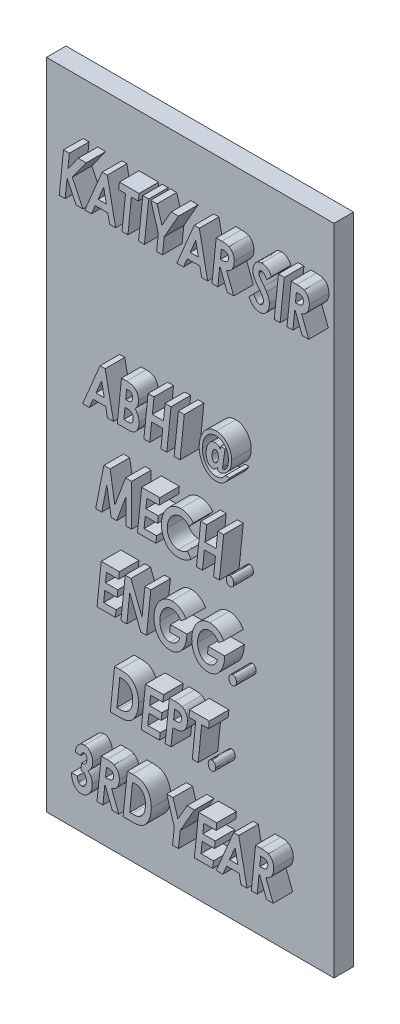
from build123d import *

# Parameters (mm, degrees)
SKETCH4_W           = 22
SKETCH4_H           = 50
BOSS_EXTRUDE5_DEPTH = 1.5
BOSS_EXTRUDE6_DEPTH = 1.5


with BuildPart() as part:
    # Sketch4 → Boss-Extrude5 (new body)
    with BuildSketch(Plane.XY):
        Rectangle(SKETCH4_W, SKETCH4_H)
    extrude(amount=BOSS_EXTRUDE5_DEPTH)

    # Sketch6 → Boss-Extrude6 (add)
    # profile 1 of 37: a face of its own
    with BuildSketch(Plane.XY.offset(1.5)):
        Polygon((-8.194085312, 21.025744477), (-7.742512796, 21.025744477), (-7.853815881, 19.934338227), (-7.072150216, 21.025744477), (-6.462845328, 21.025744477), (-7.517998573, 19.553999686), (-6.707712115, 17.850744477), (-7.236242764, 17.850744477), (-7.919961714, 19.287508299), (-8.066881787, 17.850744477), (-8.518454303, 17.850744477), align=None)
    # profile 2 of 37: a face of its own
    with BuildSketch(Plane.XY.offset(1.5)):
        Polygon((-5.233423253, 21.025744477), (-4.844180464, 21.025744477), (-4.203710713, 17.850744477), (-4.666095529, 17.850744477), (-4.805383389, 18.542731657), (-5.765770008, 18.542731657), (-6.056430064, 17.850744477), (-6.564608149, 17.850744477), align=None)
        Polygon((-4.912870368, 19.071898323), (-5.117668045, 20.088890511), (-5.543799855, 19.071898323), align=None, mode=Mode.SUBTRACT)
    # profile 3 of 37: a face of its own
    with BuildSketch(Plane.XY.offset(1.5)):
        Polygon((-3.918774815, 21.025744477), (-2.412685072, 21.025744477), (-2.466110553, 20.496577811), (-2.996549254, 20.496577811), (-3.263676658, 17.850744477), (-3.715249174, 17.850744477), (-3.448757788, 20.496577811), (-3.975380384, 20.496577811), align=None)
    # profile 4 of 37: a face of its own
    with BuildSketch(Plane.XY.offset(1.5)):
        Polygon((-2.12902121, 21.025744477), (-1.677448694, 21.025744477), (-2.001817684, 17.850744477), (-2.4533902, 17.850744477), align=None)
    # profile 5 of 37: a face of its own
    with BuildSketch(Plane.XY.offset(1.5)):
        Polygon((-1.517172251, 21.025744477), (-1.036978942, 21.025744477), (-0.661092524, 19.791234261), (0.043615008, 21.025744477), (0.600766451, 21.025744477), (-0.486187676, 19.120871681), (-0.617843325, 17.850744477), (-1.069415841, 17.850744477), (-0.937760192, 19.119599646), align=None)
    # profile 6 of 37: a face of its own
    with BuildSketch(Plane.XY.offset(1.5)):
        Polygon((1.808563927, 21.025744477), (2.197806715, 21.025744477), (2.838276467, 17.850744477), (2.375891651, 17.850744477), (2.23660379, 18.542731657), (1.276217172, 18.542731657), (0.985557116, 17.850744477), (0.477379031, 17.850744477), align=None)
        Polygon((2.129116811, 19.071898323), (1.924319135, 20.088890511), (1.498187324, 19.071898323), align=None, mode=Mode.SUBTRACT)
    # profile 7 of 37: a face of its own
    with BuildSketch(Plane.XY.offset(1.5)):
        with BuildLine():
            Line((3.488286483, 21.025744477), (3.914418294, 21.025744477))
            add(Edge.make_bspline(
                [(3.914418294, 21.025744477), (3.946013749, 21.02558055), (4.006907093, 21.025264617), (4.094512335, 21.020634991), (4.17493932, 21.01382281), (4.247956034, 21.004395676), (4.313936239, 20.992677082), (4.372311483, 20.977352568), (4.424027021, 20.960175324), (4.454548115, 20.94468554), (4.469025665, 20.937338027)],
                knots=[0, 0, 0, 0, 1.338386787, 2.579448386, 3.715441043, 4.757080431, 5.697798673, 6.551764451, 7.313035674, 8, 8, 8, 8], degree=3))
            add(Edge.make_bspline(
                [(4.469025665, 20.937338027), (4.501009461, 20.918081494), (4.563943304, 20.880190817), (4.647101111, 20.808528625), (4.71683788, 20.725479031), (4.774535668, 20.632543796), (4.819127723, 20.529835936), (4.850837238, 20.417997789), (4.870164505, 20.297114333), (4.872387775, 20.213411925), (4.873532877, 20.170300767)],
                knots=[0, 0, 0, 0, 0.979832335, 1.92799555, 2.868928801, 3.819756434, 4.792769669, 5.801434326, 6.867622663, 8, 8, 8, 8], degree=3))
            add(Edge.make_bspline(
                [(4.873532877, 20.170300767), (4.872942516, 20.143365603), (4.871778785, 20.090270525), (4.865625452, 20.012051447), (4.854341082, 19.936751443), (4.837294632, 19.864726485), (4.817516422, 19.795128326), (4.791624545, 19.728783173), (4.761910905, 19.665103564), (4.727537303, 19.604660382), (4.688911135, 19.547630854), (4.644489738, 19.495522991), (4.596411859, 19.446695971), (4.542475507, 19.403567863), (4.484410052, 19.364590633), (4.421643505, 19.330104629), (4.354183589, 19.300094269), (4.306772109, 19.284159662), (4.2826725, 19.276059982)],
                knots=[0, 0, 0, 0, 1.117975063, 2.203772433, 3.254016036, 4.274235243, 5.273756641, 6.254158089, 7.226352542, 8.187817457, 9.137168626, 10.080096755, 11.025771263, 11.976670531, 12.940588116, 13.925087063, 14.94530627, 16, 16, 16, 16], degree=3))
            Line((4.2826725, 19.276059982), (4.830283678, 17.850744477))
            Line((4.830283678, 17.850744477), (4.33100984, 17.850744477))
            Line((4.33100984, 17.850744477), (3.799299103, 19.234718836))
            Line((3.799299103, 19.234718836), (3.756685922, 19.234718836))
            Line((3.756685922, 19.234718836), (3.615490008, 17.850744477))
            Line((3.615490008, 17.850744477), (3.163917492, 17.850744477))
            Line((3.163917492, 17.850744477), (3.488286483, 21.025744477))
        make_face()
        with BuildLine():
            add(Edge.make_bspline(
                [(3.811383438, 19.763885503), (3.841919951, 19.764266963), (3.900281923, 19.764996018), (3.983482136, 19.770019276), (4.058450534, 19.778106303), (4.124931344, 19.789396515), (4.18351615, 19.803188492), (4.233812405, 19.819908635), (4.275990645, 19.840114186), (4.310119945, 19.864328877), (4.337895319, 19.89180363), (4.3617639, 19.92186547), (4.381158789, 19.955316154), (4.39852001, 19.991136019), (4.409600533, 20.030917131), (4.420007784, 20.073152698), (4.424465297, 20.118903504), (4.425332372, 20.150368877), (4.425776467, 20.166484662)],
                knots=[0, 0, 0, 0, 1.724742153, 3.29636044, 4.706031347, 5.981724593, 7.102822181, 8.102554765, 8.9701272, 9.734358223, 10.45414098, 11.170428899, 11.895372879, 12.63471237, 13.411228459, 14.221718353, 15.089208141, 16, 16, 16, 16], degree=3))
            add(Edge.make_bspline(
                [(4.425776467, 20.166484662), (4.425068705, 20.184736536), (4.423703156, 20.219951512), (4.41598371, 20.270931467), (4.400300889, 20.31672708), (4.38014593, 20.358268292), (4.353724303, 20.393818685), (4.322951317, 20.425078554), (4.285121358, 20.447891779), (4.250348681, 20.464239102), (4.217372413, 20.47311725), (4.1867786, 20.479339156), (4.150514023, 20.485090797), (4.108475871, 20.489413521), (4.060935748, 20.492287239), (4.0077301, 20.495078836), (3.948766151, 20.49604886), (3.907421857, 20.496396161), (3.8857975, 20.496577811)],
                knots=[0, 0, 0, 0, 1.191156689, 2.298205304, 3.347624297, 4.337026012, 5.296705033, 6.225607989, 7.176882654, 8.161052991, 8.721357676, 9.399318986, 10.197239802, 11.114960728, 12.154310923, 13.303309576, 14.58954667, 16, 16, 16, 16], degree=3))
            Line((3.8857975, 20.496577811), (3.811383438, 19.763885503))
        make_face(mode=Mode.SUBTRACT)
    # profile 8 of 37: a face of its own
    with BuildSketch(Plane.XY.offset(1.5)):
        with BuildLine():
            Line((7.717167693, 20.584348243), (7.365449944, 20.199557578))
            add(Edge.make_bspline(
                [(7.365449944, 20.199557578), (7.347759126, 20.229236081), (7.314136305, 20.285642461), (7.261201414, 20.362683657), (7.210354563, 20.42883098), (7.159080623, 20.482246563), (7.108772112, 20.524418437), (7.059055295, 20.554853302), (7.009841567, 20.574456647), (6.976785517, 20.576843919), (6.960942733, 20.577988067)],
                knots=[0, 0, 0, 0, 1.440449193, 2.73768944, 3.89615612, 4.915321236, 5.819779986, 6.624888153, 7.340949646, 8, 8, 8, 8], degree=3))
            add(Edge.make_bspline(
                [(6.960942733, 20.577988067), (6.946228899, 20.577102255), (6.917289601, 20.575360032), (6.875743307, 20.56244972), (6.838444982, 20.539810583), (6.805972046, 20.509588643), (6.77934767, 20.473460085), (6.759945824, 20.433374525), (6.74796658, 20.389774501), (6.746646649, 20.359487853), (6.745968774, 20.34393358)],
                knots=[0, 0, 0, 0, 0.998179953, 1.963229156, 2.918462033, 3.936979462, 4.95600521, 5.947313288, 6.945804475, 8, 8, 8, 8], degree=3))
            add(Edge.make_bspline(
                [(6.745968774, 20.34393358), (6.746878214, 20.328629587), (6.748777592, 20.296666962), (6.759153882, 20.247559338), (6.777707805, 20.19646463), (6.798294812, 20.151265751), (6.822185628, 20.110407794), (6.846667899, 20.070390447), (6.879667295, 20.023109701), (6.918470885, 19.966643219), (6.964631851, 19.901976164), (7.019307868, 19.829812621), (7.079108438, 19.748041949), (7.122569291, 19.691702811), (7.145387845, 19.662122682)],
                knots=[0, 0, 0, 0, 0.688195779, 1.437307521, 2.244653924, 3.126808026, 3.664373628, 4.370143191, 5.234058372, 6.25397291, 7.448737999, 8.803235061, 10.321580326, 12, 12, 12, 12], degree=3))
            add(Edge.make_bspline(
                [(7.145387845, 19.662122682), (7.15752074, 19.646258579), (7.180884825, 19.615709377), (7.213699204, 19.571206922), (7.243772667, 19.530781653), (7.26983056, 19.493364627), (7.293494512, 19.460241213), (7.312948454, 19.42988868), (7.330450032, 19.404288017), (7.340086565, 19.38783584), (7.344461363, 19.380366873)],
                knots=[0, 0, 0, 0, 1.388682525, 2.67415953, 3.844698302, 4.891763786, 5.844620231, 6.674610287, 7.398298968, 8, 8, 8, 8], degree=3))
            add(Edge.make_bspline(
                [(7.344461363, 19.380366873), (7.36257255, 19.348946684), (7.397730798, 19.287952404), (7.443862589, 19.19651896), (7.480785527, 19.107714326), (7.51049859, 19.021731609), (7.533200835, 18.937187585), (7.548226107, 18.852250827), (7.558253963, 18.766850533), (7.559466648, 18.709396315), (7.560071338, 18.680747482)],
                knots=[0, 0, 0, 0, 1.173579381, 2.278204904, 3.311601357, 4.283660969, 5.220630243, 6.141151512, 7.073108266, 8, 8, 8, 8], degree=3))
            add(Edge.make_bspline(
                [(7.560071338, 18.680747482), (7.55954388, 18.649128105), (7.55850733, 18.586990433), (7.547870391, 18.495799213), (7.531595805, 18.408567537), (7.508587482, 18.325093849), (7.478806867, 18.245671509), (7.442053866, 18.170101794), (7.399773636, 18.097898845), (7.35001074, 18.031035571), (7.296271071, 17.969356553), (7.237039116, 17.916496885), (7.175145552, 17.870423093), (7.108683883, 17.833703938), (7.038768872, 17.804569752), (6.964988465, 17.784574233), (6.887660595, 17.771055268), (6.834646872, 17.769914752), (6.807662484, 17.769334221)],
                knots=[0, 0, 0, 0, 1.149681703, 2.259328035, 3.334680756, 4.374924059, 5.404767829, 6.415346317, 7.428422714, 8.443317236, 9.443009251, 10.398537629, 11.325540092, 12.24384114, 13.153226749, 14.073759316, 15.01952885, 16, 16, 16, 16], degree=3))
            add(Edge.make_bspline(
                [(6.807662484, 17.769334221), (6.786867418, 17.769865214), (6.745796068, 17.770913953), (6.68492216, 17.778004547), (6.625544207, 17.7900875), (6.567736343, 17.807332895), (6.511445007, 17.829160764), (6.456432844, 17.855241885), (6.402875172, 17.886601609), (6.350864547, 17.922861344), (6.30027806, 17.963886172), (6.251230418, 18.009838597), (6.203724572, 18.060859358), (6.157219688, 18.116098541), (6.112569435, 18.176309409), (6.069382068, 18.241328517), (6.027353266, 18.311041638), (6.001583653, 18.360058795), (5.988471779, 18.384999285)],
                knots=[0, 0, 0, 0, 0.922277625, 1.821546858, 2.714105033, 3.606663208, 4.493756183, 5.389626824, 6.304057593, 7.24310398, 8.199133703, 9.190398752, 10.221536484, 11.28944813, 12.391505689, 13.544228082, 14.750475164, 16, 16, 16, 16], degree=3))
            Line((5.988471779, 18.384999285), (6.351001827, 18.754525527))
            add(Edge.make_bspline(
                [(6.351001827, 18.754525527), (6.368929585, 18.718630063), (6.403060264, 18.65029265), (6.459629831, 18.557347304), (6.516813456, 18.478194765), (6.575119943, 18.413115002), (6.635389327, 18.362381423), (6.697144812, 18.325996996), (6.760443412, 18.302574267), (6.803663096, 18.29984021), (6.82483496, 18.298500888)],
                knots=[0, 0, 0, 0, 1.393878269, 2.653650992, 3.77655092, 4.783111213, 5.683044277, 6.501875583, 7.266119398, 8, 8, 8, 8], degree=3))
            add(Edge.make_bspline(
                [(6.82483496, 18.298500888), (6.8445143, 18.299641663), (6.883161553, 18.301881974), (6.93800962, 18.32220503), (6.987692232, 18.354347524), (7.030814346, 18.398366204), (7.067046972, 18.450797867), (7.093015695, 18.509989209), (7.109864307, 18.574245525), (7.111482194, 18.61894391), (7.112314928, 18.641950407)],
                knots=[0, 0, 0, 0, 0.947253611, 1.860263177, 2.785866573, 3.78469761, 4.815330705, 5.846319549, 6.891489225, 8, 8, 8, 8], degree=3))
            add(Edge.make_bspline(
                [(7.112314928, 18.641950407), (7.111739236, 18.660653195), (7.110572928, 18.698543588), (7.099740761, 18.755242626), (7.082998847, 18.812552202), (7.063242829, 18.861460872), (7.041300864, 18.904031469), (7.018930858, 18.942945725), (6.990043248, 18.987834739), (6.955732288, 19.039533495), (6.914866757, 19.097323059), (6.867774201, 19.161553861), (6.814285686, 19.231952327), (6.77652763, 19.280959339), (6.756781074, 19.306588828)],
                knots=[0, 0, 0, 0, 0.876469376, 1.775658789, 2.697651843, 3.674479265, 4.243715328, 4.943043851, 5.778918209, 6.746950013, 7.853221914, 9.098268681, 10.482464253, 12, 12, 12, 12], degree=3))
            add(Edge.make_bspline(
                [(6.756781074, 19.306588828), (6.735403935, 19.333804078), (6.694171008, 19.386297743), (6.637496696, 19.464222002), (6.585064255, 19.535592755), (6.538993442, 19.6022926), (6.498484096, 19.663574807), (6.463276168, 19.719641457), (6.43367989, 19.770403944), (6.417211177, 19.803239273), (6.409515449, 19.818583019)],
                knots=[0, 0, 0, 0, 1.340413371, 2.585433281, 3.73200924, 4.770789006, 5.725145833, 6.577364766, 7.335211384, 8, 8, 8, 8], degree=3))
            add(Edge.make_bspline(
                [(6.409515449, 19.818583019), (6.392231396, 19.857020641), (6.358420469, 19.932212009), (6.324885301, 20.048903408), (6.302305724, 20.163914001), (6.299565035, 20.240583462), (6.298212364, 20.278423764)],
                knots=[0, 0, 0, 0, 1.059271898, 2.072139195, 3.048502048, 4, 4, 4, 4], degree=3))
            add(Edge.make_bspline(
                [(6.298212364, 20.278423764), (6.298760465, 20.30281802), (6.299849354, 20.351281031), (6.306735241, 20.422961397), (6.319058458, 20.49259882), (6.335502565, 20.560484725), (6.35711984, 20.626352193), (6.383457059, 20.690543146), (6.414288968, 20.752760832), (6.438672979, 20.792291048), (6.450856595, 20.812042554)],
                knots=[0, 0, 0, 0, 1.04033109, 2.066780722, 3.067097083, 4.053838885, 5.043062645, 6.020190056, 7.010776241, 8, 8, 8, 8], degree=3))
            add(Edge.make_bspline(
                [(6.450856595, 20.812042554), (6.467085933, 20.835551827), (6.498593889, 20.881193189), (6.553408299, 20.94148261), (6.611969775, 20.99305558), (6.675582113, 21.034505395), (6.742733415, 21.067525283), (6.814331592, 21.090309403), (6.889959516, 21.104932649), (6.942004587, 21.106403716), (6.968574944, 21.107154734)],
                knots=[0, 0, 0, 0, 1.09852889, 2.132705499, 3.127598254, 4.094039233, 5.046599829, 5.998845788, 6.978358935, 8, 8, 8, 8], degree=3))
            add(Edge.make_bspline(
                [(6.968574944, 21.107154734), (7.005164583, 21.105530148), (7.077671137, 21.102310845), (7.184216861, 21.07749056), (7.285309705, 21.035124989), (7.382785107, 20.978259843), (7.47383978, 20.902772231), (7.56140585, 20.812655537), (7.643815037, 20.705495152), (7.692083074, 20.6257772), (7.717167693, 20.584348243)],
                knots=[0, 0, 0, 0, 0.91506235, 1.813300668, 2.719648529, 3.649492432, 4.626318364, 5.669260118, 6.788728039, 8, 8, 8, 8], degree=3))
        make_face()
    # profile 9 of 37: a face of its own
    with BuildSketch(Plane.XY.offset(1.5)):
        Polygon((8.250786483, 21.025744477), (8.702358999, 21.025744477), (8.377990008, 17.850744477), (7.926417492, 17.850744477), align=None)
    # profile 10 of 37: a face of its own
    with BuildSketch(Plane.XY.offset(1.5)):
        with BuildLine():
            Line((9.22770956, 21.025744477), (9.653841371, 21.025744477))
            add(Edge.make_bspline(
                [(9.653841371, 21.025744477), (9.685436826, 21.02558055), (9.74633017, 21.025264617), (9.833935412, 21.020634991), (9.914362397, 21.01382281), (9.987379111, 21.004395676), (10.053359316, 20.992677082), (10.11173456, 20.977352568), (10.163450098, 20.960175324), (10.193971192, 20.94468554), (10.208448742, 20.937338027)],
                knots=[0, 0, 0, 0, 1.338386787, 2.579448386, 3.715441043, 4.757080431, 5.697798673, 6.551764451, 7.313035674, 8, 8, 8, 8], degree=3))
            add(Edge.make_bspline(
                [(10.208448742, 20.937338027), (10.240432538, 20.918081494), (10.303366381, 20.880190817), (10.386524188, 20.808528625), (10.456260957, 20.725479031), (10.513958745, 20.632543796), (10.5585508, 20.529835936), (10.590260315, 20.417997789), (10.609587581, 20.297114333), (10.611810852, 20.213411925), (10.612955954, 20.170300767)],
                knots=[0, 0, 0, 0, 0.979832335, 1.92799555, 2.868928801, 3.819756434, 4.792769669, 5.801434326, 6.867622663, 8, 8, 8, 8], degree=3))
            add(Edge.make_bspline(
                [(10.612955954, 20.170300767), (10.612365593, 20.143365603), (10.611201862, 20.090270525), (10.605048529, 20.012051447), (10.593764159, 19.936751443), (10.576717709, 19.864726485), (10.556939499, 19.795128326), (10.531047622, 19.728783173), (10.501333982, 19.665103564), (10.46696038, 19.604660382), (10.428334212, 19.547630854), (10.383912815, 19.495522991), (10.335834935, 19.446695971), (10.281898584, 19.403567863), (10.223833129, 19.364590633), (10.161066582, 19.330104629), (10.093606666, 19.300094269), (10.046195186, 19.284159662), (10.022095577, 19.276059982)],
                knots=[0, 0, 0, 0, 1.117975063, 2.203772433, 3.254016036, 4.274235243, 5.273756641, 6.254158089, 7.226352542, 8.187817457, 9.137168626, 10.080096755, 11.025771263, 11.976670531, 12.940588116, 13.925087063, 14.94530627, 16, 16, 16, 16], degree=3))
            Line((10.022095577, 19.276059982), (10.569706755, 17.850744477))
            Line((10.569706755, 17.850744477), (10.070432917, 17.850744477))
            Line((10.070432917, 17.850744477), (9.53872218, 19.234718836))
            Line((9.53872218, 19.234718836), (9.496108999, 19.234718836))
            Line((9.496108999, 19.234718836), (9.354913085, 17.850744477))
            Line((9.354913085, 17.850744477), (8.903340569, 17.850744477))
            Line((8.903340569, 17.850744477), (9.22770956, 21.025744477))
        make_face()
        with BuildLine():
            add(Edge.make_bspline(
                [(9.550806515, 19.763885503), (9.581343028, 19.764266963), (9.639705, 19.764996018), (9.722905213, 19.770019276), (9.797873611, 19.778106303), (9.864354421, 19.789396515), (9.922939227, 19.803188492), (9.973235482, 19.819908635), (10.015413722, 19.840114186), (10.049543022, 19.864328877), (10.077318396, 19.89180363), (10.101186977, 19.92186547), (10.120581866, 19.955316154), (10.137943087, 19.991136019), (10.14902361, 20.030917131), (10.159430861, 20.073152698), (10.163888374, 20.118903504), (10.164755449, 20.150368877), (10.165199544, 20.166484662)],
                knots=[0, 0, 0, 0, 1.724742153, 3.29636044, 4.706031347, 5.981724593, 7.102822181, 8.102554765, 8.9701272, 9.734358223, 10.45414098, 11.170428899, 11.895372879, 12.63471237, 13.411228459, 14.221718353, 15.089208141, 16, 16, 16, 16], degree=3))
            add(Edge.make_bspline(
                [(10.165199544, 20.166484662), (10.164491782, 20.184736536), (10.163126233, 20.219951512), (10.155406787, 20.270931467), (10.139723966, 20.31672708), (10.119569007, 20.358268292), (10.093147379, 20.393818685), (10.062374394, 20.425078554), (10.024544435, 20.447891779), (9.989771758, 20.464239102), (9.95679549, 20.47311725), (9.926201677, 20.479339156), (9.8899371, 20.485090797), (9.847898948, 20.489413521), (9.800358825, 20.492287239), (9.747153177, 20.495078836), (9.688189228, 20.49604886), (9.646844934, 20.496396161), (9.625220577, 20.496577811)],
                knots=[0, 0, 0, 0, 1.191156689, 2.298205304, 3.347624297, 4.337026012, 5.296705033, 6.225607989, 7.176882654, 8.161052991, 8.721357676, 9.399318986, 10.197239802, 11.114960728, 12.154310923, 13.303309576, 14.58954667, 16, 16, 16, 16], degree=3))
            Line((9.625220577, 20.496577811), (9.550806515, 19.763885503))
        make_face(mode=Mode.SUBTRACT)
    # profile 11 of 37: a face of its own
    with BuildSketch(Plane.XY.offset(1.5)):
        Polygon((-5.396243766, 8.116770118), (-5.007000977, 8.116770118), (-4.366531226, 4.941770118), (-4.828916041, 4.941770118), (-4.968203902, 5.633757298), (-5.92859052, 5.633757298), (-6.219250577, 4.941770118), (-6.727428662, 4.941770118), align=None)
        Polygon((-5.075690881, 6.162923965), (-5.280488557, 7.179916152), (-5.706620368, 6.162923965), align=None, mode=Mode.SUBTRACT)
    # profile 12 of 37: a face of its own
    with BuildSketch(Plane.XY.offset(1.5)):
        with BuildLine():
            Line((-3.757226338, 8.116770118), (-3.367347532, 8.116770118))
            add(Edge.make_bspline(
                [(-3.367347532, 8.116770118), (-3.338504521, 8.116670772), (-3.282888396, 8.116479208), (-3.202285782, 8.110941856), (-3.127596251, 8.103506278), (-3.058229103, 8.093735682), (-2.99500814, 8.079645741), (-2.937119715, 8.063181491), (-2.884971055, 8.043876671), (-2.823539048, 8.012977048), (-2.754298679, 7.965463717), (-2.678386688, 7.897213798), (-2.614024193, 7.812759012), (-2.557134536, 7.718214108), (-2.510926257, 7.614661261), (-2.478152568, 7.50518784), (-2.4565922, 7.391919397), (-2.454464182, 7.314850456), (-2.4533902, 7.275954814)],
                knots=[0, 0, 0, 0, 0.975894446, 1.881754566, 2.732761623, 3.516110292, 4.250760301, 4.922908887, 5.551891901, 6.129461712, 7.2458477, 8.383428734, 9.569006701, 10.824104868, 12.112097696, 13.394482693, 14.685030986, 16, 16, 16, 16], degree=3))
            add(Edge.make_bspline(
                [(-2.4533902, 7.275954814), (-2.45423512, 7.243262267), (-2.455904757, 7.178658954), (-2.469552347, 7.083133872), (-2.492672081, 6.990548606), (-2.52412608, 6.901389059), (-2.564018684, 6.817130159), (-2.612718579, 6.739691024), (-2.669332985, 6.668977303), (-2.713211806, 6.627989382), (-2.735146009, 6.607500287)],
                knots=[0, 0, 0, 0, 1.048957551, 2.072831274, 3.089421262, 4.107376656, 5.102609843, 6.074875552, 7.037666253, 8, 8, 8, 8], degree=3))
            add(Edge.make_bspline(
                [(-2.735146009, 6.607500287), (-2.709291269, 6.58242433), (-2.658049212, 6.532725761), (-2.59268858, 6.448545375), (-2.536813703, 6.359120257), (-2.491396305, 6.263242912), (-2.455533218, 6.161435651), (-2.43131569, 6.053154207), (-2.41535547, 5.939308201), (-2.413588909, 5.861296262), (-2.412685072, 5.821382498)],
                knots=[0, 0, 0, 0, 0.985995519, 1.954165378, 2.911801336, 3.87072296, 4.855588123, 5.863254973, 6.906763013, 8, 8, 8, 8], degree=3))
            add(Edge.make_bspline(
                [(-2.412685072, 5.821382498), (-2.413819797, 5.779747888), (-2.416056197, 5.697691341), (-2.436385817, 5.577497521), (-2.469376688, 5.462519531), (-2.516018541, 5.355178006), (-2.569952909, 5.256389258), (-2.632976096, 5.171121242), (-2.701123059, 5.098712914), (-2.764496861, 5.049536754), (-2.819449935, 5.017576661), (-2.864906758, 4.997312223), (-2.914536864, 4.980249608), (-2.968605522, 4.966392277), (-3.026717781, 4.954722934), (-3.089494832, 4.947702956), (-3.156299697, 4.942054215), (-3.202393005, 4.941866748), (-3.226151618, 4.941770118)],
                knots=[0, 0, 0, 0, 1.469776143, 2.8967428, 4.292714978, 5.685167174, 7.022871031, 8.260117555, 9.420157334, 10.52563317, 11.079270911, 11.662509173, 12.280667607, 12.930971386, 13.633033648, 14.372448833, 15.161085193, 16, 16, 16, 16], degree=3))
            Line((-3.226151618, 4.941770118), (-4.081595328, 4.941770118))
            Line((-4.081595328, 4.941770118), (-3.757226338, 8.116770118))
        make_face()
        with BuildLine():
            Line((-3.434129383, 6.854911144), (-3.344450897, 6.854911144))
            add(Edge.make_bspline(
                [(-3.344450897, 6.854911144), (-3.313695251, 6.855350232), (-3.257600797, 6.856151074), (-3.18141471, 6.862798961), (-3.12108122, 6.873401), (-3.073748387, 6.889211872), (-3.036827874, 6.913698607), (-3.005010952, 6.944856053), (-2.975586853, 6.983376134), (-2.950181567, 7.029206305), (-2.927624865, 7.079769521), (-2.913070998, 7.134793929), (-2.902778077, 7.192041096), (-2.901698004, 7.231172802), (-2.90114661, 7.251150126)],
                knots=[0, 0, 0, 0, 1.60032435, 2.918791578, 3.974691023, 4.784360933, 5.494310405, 6.258984406, 7.09308981, 8.00719273, 8.980683918, 9.965734359, 10.961476823, 12, 12, 12, 12], degree=3))
            add(Edge.make_bspline(
                [(-2.90114661, 7.251150126), (-2.901500859, 7.269424609), (-2.902193342, 7.305147442), (-2.91142439, 7.35635474), (-2.925397059, 7.403885717), (-2.945040729, 7.44683613), (-2.968852171, 7.484837026), (-2.996378807, 7.516892236), (-3.028269469, 7.541575785), (-3.058251933, 7.556708986), (-3.085641623, 7.566261664), (-3.111132844, 7.571486514), (-3.141038573, 7.576572637), (-3.17559877, 7.581107355), (-3.214870713, 7.584140766), (-3.258789129, 7.58582944), (-3.307342438, 7.587156836), (-3.341269778, 7.587449712), (-3.359079303, 7.587603452)],
                knots=[0, 0, 0, 0, 1.315058415, 2.570667064, 3.735268981, 4.876803182, 5.961641154, 6.957440426, 7.904605142, 8.847325369, 9.36419389, 9.990463295, 10.718707533, 11.550451555, 12.500567713, 13.555529014, 14.716820544, 16, 16, 16, 16], degree=3))
            Line((-3.359079303, 7.587603452), (-3.434129383, 6.854911144))
        make_face(mode=Mode.SUBTRACT)
        with BuildLine():
            Line((-3.575325296, 5.470936785), (-3.28212117, 5.458216432))
            add(Edge.make_bspline(
                [(-3.28212117, 5.458216432), (-3.264299032, 5.45860021), (-3.229851552, 5.459341993), (-3.180112613, 5.464518007), (-3.134057979, 5.47250257), (-3.091753281, 5.484472107), (-3.053618662, 5.500617903), (-3.018594295, 5.519078229), (-2.987190481, 5.541141112), (-2.951585226, 5.576610274), (-2.914326056, 5.628169259), (-2.882081761, 5.700122859), (-2.863843066, 5.782540681), (-2.861610913, 5.840583237), (-2.860441482, 5.870991873)],
                knots=[0, 0, 0, 0, 0.949502302, 1.835243548, 2.66173537, 3.437576639, 4.171842431, 4.864247976, 5.544474933, 6.207507029, 7.533859883, 8.909100507, 10.380670286, 12, 12, 12, 12], degree=3))
            add(Edge.make_bspline(
                [(-2.860441482, 5.870991873), (-2.861061597, 5.893951249), (-2.862270897, 5.938724871), (-2.875053366, 6.003853326), (-2.894575299, 6.065300286), (-2.921980472, 6.122293979), (-2.954992939, 6.173690734), (-2.994577361, 6.21729478), (-3.039345271, 6.252471671), (-3.081354504, 6.275467439), (-3.119555362, 6.290148158), (-3.154770755, 6.298237846), (-3.195550763, 6.30705736), (-3.24264452, 6.312604545), (-3.295354871, 6.318835902), (-3.354172876, 6.322200755), (-3.418842031, 6.324833925), (-3.464018848, 6.325432589), (-3.487554863, 6.325744477)],
                knots=[0, 0, 0, 0, 1.22801409, 2.394779379, 3.540082136, 4.67248285, 5.771438622, 6.800122652, 7.810794234, 8.806562507, 9.352687556, 9.997013741, 10.738443369, 11.586201183, 12.534023234, 13.580717588, 14.739613093, 16, 16, 16, 16], degree=3))
            Line((-3.487554863, 6.325744477), (-3.575325296, 5.470936785))
        make_face(mode=Mode.SUBTRACT)
    # profile 13 of 37: a face of its own
    with BuildSketch(Plane.XY.offset(1.5)):
        Polygon((-1.721969928, 8.116770118), (-1.270397412, 8.116770118), (-1.395056867, 6.895616272), (-0.54406528, 6.895616272), (-0.419405825, 8.116770118), (0.032166691, 8.116770118), (-0.292202299, 4.941770118), (-0.743774815, 4.941770118), (-0.598126779, 6.366449606), (-1.449118365, 6.366449606), (-1.594766402, 4.941770118), (-2.046338918, 4.941770118), align=None)
    # profile 14 of 37: a face of its own
    with BuildSketch(Plane.XY.offset(1.5)):
        Polygon((0.59822238, 8.116770118), (1.049794896, 8.116770118), (0.725425906, 4.941770118), (0.27385339, 4.941770118), align=None)
    # profile 15 of 37: a face of its own
    with BuildSketch(Plane.XY.offset(1.5)):
        with BuildLine():
            Line((4.19426605, 5.633757298), (4.508458758, 5.633757298))
            add(Edge.make_bspline(
                [(4.508458758, 5.633757298), (4.493622258, 5.609587619), (4.464784392, 5.562608753), (4.422778288, 5.494299582), (4.38041404, 5.432264561), (4.340351239, 5.374495154), (4.301322081, 5.32192059), (4.262910458, 5.274979053), (4.226821695, 5.232416429), (4.179475642, 5.183767299), (4.118883086, 5.12862585), (4.04052422, 5.070957337), (3.956633541, 5.020046019), (3.867307915, 4.978154746), (3.774624567, 4.943149147), (3.678954517, 4.919444039), (3.581641316, 4.904059547), (3.51611702, 4.90206635), (3.483198342, 4.90106499)],
                knots=[0, 0, 0, 0, 1.024912396, 1.992133294, 2.897347726, 3.739022679, 4.532746337, 5.262633967, 5.930759962, 6.548442663, 7.714714776, 8.886935694, 10.058956301, 11.254971021, 12.447594597, 13.633109757, 14.810900638, 16, 16, 16, 16], degree=3))
            add(Edge.make_bspline(
                [(3.483198342, 4.90106499), (3.454113695, 4.901550366), (3.396161873, 4.902517489), (3.310334281, 4.914181958), (3.225872459, 4.930746879), (3.143613288, 4.956252745), (3.062465766, 4.987302571), (2.982888113, 5.025551108), (2.904998573, 5.071078832), (2.829163591, 5.122987294), (2.755887264, 5.180818426), (2.686843842, 5.244416122), (2.621591333, 5.312808008), (2.560498142, 5.386177347), (2.503080402, 5.464388311), (2.450394972, 5.548137315), (2.401209257, 5.636517848), (2.357190377, 5.729804538), (2.317065817, 5.826299097), (2.282017753, 5.925391261), (2.252842324, 6.026977774), (2.228515124, 6.130510668), (2.210249949, 6.236319926), (2.196977582, 6.343927315), (2.188245546, 6.453651611), (2.187414285, 6.527557342), (2.186994415, 6.564887106)],
                knots=[0, 0, 0, 0, 0.895158887, 1.783624545, 2.663385574, 3.543364663, 4.43221415, 5.337579127, 6.259279326, 7.208306386, 8.165875957, 9.131758016, 10.097021882, 11.075185756, 12.070375228, 13.082998856, 14.120577937, 15.183709933, 16.258091894, 17.338173324, 18.418965075, 19.511839661, 20.612179271, 21.72417851, 22.850483213, 24, 24, 24, 24], degree=3))
            add(Edge.make_bspline(
                [(2.186994415, 6.564887106), (2.187420406, 6.602429051), (2.188268627, 6.677181511), (2.197004396, 6.788167118), (2.21001959, 6.897345137), (2.22940619, 7.004257738), (2.253328066, 7.109457507), (2.283371994, 7.212345395), (2.318444848, 7.313460576), (2.358947434, 7.411906567), (2.403744034, 7.506914209), (2.452825802, 7.597078786), (2.506166681, 7.681624693), (2.563502234, 7.760509656), (2.624184349, 7.834258791), (2.688980506, 7.902565393), (2.758660681, 7.964572118), (2.830819969, 8.022203972), (2.906631615, 8.072696724), (2.983970842, 8.117828989), (3.064256155, 8.154304785), (3.145255779, 8.186079875), (3.228873638, 8.209456704), (3.313869423, 8.226667051), (3.40088532, 8.237227387), (3.459424646, 8.238329932), (3.4889225, 8.238885503)],
                knots=[0, 0, 0, 0, 1.147742502, 2.285352446, 3.402233458, 4.508566385, 5.606223253, 6.699737282, 7.784298369, 8.877408784, 9.953254958, 10.994743099, 12.014517383, 13.007798954, 13.974796417, 14.933128129, 15.883356529, 16.824943381, 17.754514118, 18.66635147, 19.55968035, 20.448197729, 21.324426915, 22.210576173, 23.098312771, 24, 24, 24, 24], degree=3))
            add(Edge.make_bspline(
                [(3.4889225, 8.238885503), (3.529494097, 8.237703547), (3.6096123, 8.235369494), (3.727381029, 8.21557981), (3.840401356, 8.184069236), (3.948305042, 8.138887214), (4.051289775, 8.081184997), (4.149612092, 8.01081154), (4.242848585, 7.927524292), (4.32945033, 7.832586198), (4.409092643, 7.730016385), (4.478455052, 7.621423417), (4.538136691, 7.509127865), (4.58683805, 7.392330922), (4.623483525, 7.270920697), (4.6500825, 7.145837499), (4.66753547, 7.01673888), (4.669176046, 6.929170225), (4.670007236, 6.884803973)],
                knots=[0, 0, 0, 0, 0.976530426, 1.92839001, 2.86746997, 3.796713146, 4.738454258, 5.704719891, 6.702834947, 7.74350282, 8.795395085, 9.826462182, 10.842810635, 11.854531702, 12.868813295, 13.892254643, 14.932120614, 16, 16, 16, 16], degree=3))
            add(Edge.make_bspline(
                [(4.670007236, 6.884803973), (4.669495086, 6.852352887), (4.668486326, 6.788435378), (4.661217218, 6.694202927), (4.650290971, 6.603426897), (4.633249482, 6.516267617), (4.612778768, 6.432378952), (4.586326661, 6.352015845), (4.556035933, 6.274988175), (4.520876057, 6.20183003), (4.482114888, 6.132294157), (4.439390708, 6.066792285), (4.393499156, 6.005005577), (4.344715563, 5.946729373), (4.291331179, 5.893417238), (4.23569102, 5.843018763), (4.176208299, 5.79677887), (4.134054624, 5.769560591), (4.112855794, 5.755872682)],
                knots=[0, 0, 0, 0, 1.182442205, 2.329005624, 3.442504373, 4.512233529, 5.563417001, 6.587099497, 7.592782035, 8.577624589, 9.542631136, 10.491923163, 11.425204141, 12.346156494, 13.258481087, 14.172113205, 15.080766721, 16, 16, 16, 16], degree=3))
            add(Edge.make_bspline(
                [(4.112855794, 5.755872682), (4.081614352, 5.73738943), (4.023222714, 5.702843412), (3.936135781, 5.664272248), (3.856873815, 5.639089077), (3.805806987, 5.635446438), (3.782126627, 5.633757298)],
                knots=[0, 0, 0, 0, 1.220758023, 2.281650873, 3.203178887, 4, 4, 4, 4], degree=3))
            add(Edge.make_bspline(
                [(3.782126627, 5.633757298), (3.766139683, 5.634636798), (3.735372154, 5.636329433), (3.69148664, 5.648711985), (3.652295795, 5.669626138), (3.631584985, 5.690224592), (3.621214167, 5.700539149)],
                knots=[0, 0, 0, 0, 1.067981458, 2.055374167, 3.026239878, 4, 4, 4, 4], degree=3))
            add(Edge.make_bspline(
                [(3.621214167, 5.700539149), (3.613689475, 5.70954209), (3.597577135, 5.728819749), (3.583285518, 5.767207906), (3.573843085, 5.813077204), (3.571977003, 5.846547804), (3.570968774, 5.864631697)],
                knots=[0, 0, 0, 0, 0.798187743, 1.709129218, 2.762261177, 4, 4, 4, 4], degree=3))
            add(Edge.make_bspline(
                [(3.570968774, 5.864631697), (3.559373513, 5.846428204), (3.537067847, 5.811410363), (3.500320717, 5.76365324), (3.460547416, 5.724239468), (3.419576816, 5.690958831), (3.37628715, 5.665390091), (3.3308271, 5.647212689), (3.283597373, 5.636095091), (3.251321941, 5.634537616), (3.235151467, 5.633757298)],
                knots=[0, 0, 0, 0, 1.212178879, 2.331853949, 3.376027199, 4.350581462, 5.290089863, 6.187917377, 7.09211952, 8, 8, 8, 8], degree=3))
            add(Edge.make_bspline(
                [(3.235151467, 5.633757298), (3.216865274, 5.634284931), (3.180844546, 5.635324279), (3.128298776, 5.646067498), (3.077927501, 5.662564495), (3.030180519, 5.686427315), (2.984451022, 5.716486569), (2.941887321, 5.754050849), (2.900818833, 5.797394974), (2.863069261, 5.847762167), (2.828285302, 5.903132633), (2.798122957, 5.963661113), (2.773035094, 6.028492603), (2.751623877, 6.097665117), (2.736221964, 6.171403992), (2.724703276, 6.249553027), (2.717702299, 6.331978249), (2.71668196, 6.388484741), (2.716161082, 6.417331016)],
                knots=[0, 0, 0, 0, 0.839542189, 1.653757043, 2.455037698, 3.270068691, 4.099881842, 4.963514603, 5.87357361, 6.840360885, 7.851705109, 8.875927273, 9.943688885, 11.044258427, 12.200711619, 13.402553577, 14.674016925, 16, 16, 16, 16], degree=3))
            add(Edge.make_bspline(
                [(2.716161082, 6.417331016), (2.716794166, 6.449577581), (2.718041947, 6.513134146), (2.727292999, 6.607235154), (2.741714527, 6.698616553), (2.762118287, 6.787724666), (2.788794351, 6.874000286), (2.821449684, 6.957673985), (2.859554474, 7.038859999), (2.903855515, 7.116041556), (2.951419641, 7.188541416), (3.005644136, 7.250900065), (3.061994329, 7.305481092), (3.123686089, 7.348728795), (3.188699048, 7.383237538), (3.257901266, 7.407535591), (3.33125496, 7.421658199), (3.381374898, 7.423729201), (3.406876226, 7.424782939)],
                knots=[0, 0, 0, 0, 1.145254244, 2.257245897, 3.355382013, 4.42950084, 5.501373521, 6.559990681, 7.617723593, 8.68346813, 9.719424406, 10.691412579, 11.612998638, 12.49891256, 13.35785118, 14.22001878, 15.094334783, 16, 16, 16, 16], degree=3))
            add(Edge.make_bspline(
                [(3.406876226, 7.424782939), (3.427718054, 7.424137309), (3.468709168, 7.422867504), (3.528186125, 7.410244507), (3.584471193, 7.390572061), (3.636902415, 7.362001904), (3.68646654, 7.326261483), (3.731533556, 7.281709888), (3.773727463, 7.22975102), (3.796850424, 7.190230649), (3.808839367, 7.16973987)],
                knots=[0, 0, 0, 0, 0.996252177, 1.959400475, 2.896542216, 3.840798127, 4.80688164, 5.811469939, 6.865276685, 8, 8, 8, 8], degree=3))
            Line((3.808839367, 7.16973987), (3.843184319, 7.384077811))
            Line((3.843184319, 7.384077811), (4.163101186, 7.384077811))
            Line((4.163101186, 7.384077811), (3.995192532, 6.168012106))
            add(Edge.make_bspline(
                [(3.995192532, 6.168012106), (3.99254498, 6.148944115), (3.987871966, 6.115288499), (3.983096106, 6.071764597), (3.979543877, 6.042116846), (3.978416374, 6.027030807), (3.978020056, 6.021728051)],
                knots=[0, 0, 0, 0, 1.568095818, 2.767739479, 3.566859366, 4, 4, 4, 4], degree=3))
            add(Edge.make_bspline(
                [(3.978020056, 6.021728051), (3.978916991, 6.014092115), (3.980775748, 5.998267829), (3.995014344, 5.978556313), (4.013663794, 5.962541215), (4.029470179, 5.960427799), (4.037169696, 5.959398323)],
                knots=[0, 0, 0, 0, 0.966814083, 2.003571298, 3.027510966, 4, 4, 4, 4], degree=3))
            add(Edge.make_bspline(
                [(4.037169696, 5.959398323), (4.048171896, 5.960915242), (4.073186216, 5.964364069), (4.110759176, 5.986159269), (4.153499075, 6.017656134), (4.200427984, 6.061248688), (4.248668582, 6.116254973), (4.291461659, 6.18472185), (4.330187782, 6.263425093), (4.364117125, 6.351942564), (4.39190727, 6.448274151), (4.411289399, 6.550706072), (4.423838109, 6.657432454), (4.425124062, 6.73021552), (4.425776467, 6.767140711)],
                knots=[0, 0, 0, 0, 0.416327137, 0.946550737, 1.611490093, 2.427878045, 3.359330676, 4.368174684, 5.468011125, 6.670048711, 7.945366964, 9.250920359, 10.605303459, 12, 12, 12, 12], degree=3))
            add(Edge.make_bspline(
                [(4.425776467, 6.767140711), (4.424643949, 6.821715617), (4.42243926, 6.927957343), (4.399253733, 7.0819555), (4.363751071, 7.226511752), (4.311698474, 7.35997684), (4.248221659, 7.482992938), (4.169857114, 7.591903796), (4.079179891, 7.687456272), (3.99331599, 7.754845287), (3.919117864, 7.800646934), (3.861859739, 7.831398676), (3.801726089, 7.856021236), (3.740330776, 7.877446163), (3.676302085, 7.892779865), (3.610642267, 7.905635795), (3.542661029, 7.911375978), (3.496772585, 7.91261857), (3.473658077, 7.913244477)],
                knots=[0, 0, 0, 0, 1.5665116, 3.049549891, 4.463039625, 5.833731779, 7.154881627, 8.429149593, 9.673988779, 10.927556077, 11.551129024, 12.177668557, 12.791803098, 13.415762498, 14.04348474, 14.681316824, 15.335764965, 16, 16, 16, 16], degree=3))
            add(Edge.make_bspline(
                [(3.473658077, 7.913244477), (3.449252835, 7.912813835), (3.400723204, 7.911957505), (3.329083284, 7.903332733), (3.259351433, 7.890008544), (3.191436879, 7.871521914), (3.12549838, 7.847427637), (3.061486933, 7.817690561), (2.998956656, 7.783760986), (2.939403686, 7.743069697), (2.881474729, 7.69914316), (2.827095997, 7.649491348), (2.775794983, 7.595787321), (2.72790446, 7.537280988), (2.682626878, 7.475003864), (2.640655042, 7.408017594), (2.601861255, 7.336618753), (2.566373601, 7.261233917), (2.534934849, 7.182529275), (2.506505213, 7.101903511), (2.483983264, 7.018845638), (2.464837531, 6.934185274), (2.449430517, 6.847629441), (2.438700672, 6.758882207), (2.432180096, 6.668233888), (2.431544724, 6.607087112), (2.431225185, 6.576335423)],
                knots=[0, 0, 0, 0, 0.929745646, 1.848791826, 2.745692526, 3.633631858, 4.528273267, 5.417645145, 6.321723195, 7.236033368, 8.163670107, 9.090356273, 10.03904316, 10.991850015, 11.969646448, 12.971711802, 14.002170987, 15.064818312, 16.145104774, 17.231087066, 18.320999795, 19.4226197, 20.538459581, 21.669928315, 22.828169775, 24, 24, 24, 24], degree=3))
            add(Edge.make_bspline(
                [(2.431225185, 6.576335423), (2.431470883, 6.544943286), (2.43195794, 6.482713302), (2.439526449, 6.390422685), (2.450233516, 6.300245576), (2.464410438, 6.212174876), (2.484686123, 6.126823476), (2.507828336, 6.043429158), (2.536052444, 5.962365134), (2.568322412, 5.883798256), (2.604432218, 5.808422055), (2.643752413, 5.736811527), (2.687158464, 5.670048717), (2.733761604, 5.607262857), (2.783951329, 5.548845795), (2.83746559, 5.494604454), (2.894466072, 5.444696146), (2.954542504, 5.399112733), (3.017376422, 5.358313995), (3.082618183, 5.323365656), (3.149405468, 5.293127103), (3.218295732, 5.269277519), (3.288710215, 5.249632988), (3.361147068, 5.236809787), (3.435487569, 5.227907079), (3.485715079, 5.227110118), (3.511183117, 5.226706016)],
                knots=[0, 0, 0, 0, 1.170929509, 2.321184021, 3.452433365, 4.559078884, 5.647021436, 6.723778032, 7.786938488, 8.847506296, 9.891214788, 10.90382618, 11.893342877, 12.859957507, 13.819164521, 14.76444163, 15.700539783, 16.643430996, 17.575912788, 18.492558832, 19.402525316, 20.308149575, 21.210035289, 22.126954327, 23.050265492, 24, 24, 24, 24], degree=3))
            add(Edge.make_bspline(
                [(3.511183117, 5.226706016), (3.540965515, 5.227708861), (3.60022534, 5.229704283), (3.687479237, 5.248862899), (3.772676352, 5.277001014), (3.855827524, 5.31899421), (3.938421235, 5.375307014), (4.022878906, 5.446328682), (4.10954054, 5.53347941), (4.16506509, 5.599196154), (4.19426605, 5.633757298)],
                knots=[0, 0, 0, 0, 0.866123431, 1.723377829, 2.590227089, 3.47375685, 4.425812056, 5.495332781, 6.682768512, 8, 8, 8, 8], degree=3))
        make_face()
        with BuildLine():
            add(Edge.make_bspline(
                [(3.384615609, 6.081513708), (3.394202894, 6.082021676), (3.413003787, 6.083017814), (3.440575163, 6.090446269), (3.466784943, 6.102442549), (3.491355126, 6.120382607), (3.514703785, 6.142730469), (3.537302289, 6.169569616), (3.557226493, 6.201940455), (3.583882453, 6.25064258), (3.611792713, 6.317997488), (3.634806964, 6.404462712), (3.650388373, 6.495637501), (3.651704605, 6.558247139), (3.652379031, 6.590327811)],
                knots=[0, 0, 0, 0, 0.551585748, 1.081672819, 1.633393677, 2.202536676, 2.824373619, 3.491878571, 4.21666405, 5.008859935, 6.689050689, 8.398094068, 10.154412516, 12, 12, 12, 12], degree=3))
            add(Edge.make_bspline(
                [(3.652379031, 6.590327811), (3.651692275, 6.617502054), (3.650376391, 6.669570343), (3.639213533, 6.74385544), (3.619414357, 6.81019742), (3.592677246, 6.867928541), (3.559821397, 6.914971294), (3.523663852, 6.951488496), (3.480688346, 6.972712705), (3.450542848, 6.975590301), (3.43549702, 6.977026529)],
                knots=[0, 0, 0, 0, 1.340604747, 2.568719038, 3.694051523, 4.747028557, 5.693245736, 6.514694947, 7.258673906, 8, 8, 8, 8], degree=3))
            add(Edge.make_bspline(
                [(3.43549702, 6.977026529), (3.417520853, 6.975342716), (3.38041912, 6.971867426), (3.329267626, 6.940323356), (3.282702103, 6.892550617), (3.241865491, 6.82801238), (3.206498494, 6.75162585), (3.182221116, 6.66505902), (3.166558511, 6.57139383), (3.164815342, 6.506228904), (3.163917492, 6.472664549)],
                knots=[0, 0, 0, 0, 0.688151065, 1.420302711, 2.252758836, 3.25047028, 4.347936729, 5.488908477, 6.706617644, 8, 8, 8, 8], degree=3))
            add(Edge.make_bspline(
                [(3.163917492, 6.472664549), (3.164580359, 6.444638083), (3.165846985, 6.391084282), (3.177220079, 6.315022698), (3.196010181, 6.247483483), (3.222192066, 6.189373933), (3.25519514, 6.142414317), (3.293067811, 6.106805487), (3.337589614, 6.085811904), (3.368940277, 6.08294644), (3.384615609, 6.081513708)],
                knots=[0, 0, 0, 0, 1.357853392, 2.594626438, 3.716799801, 4.746725114, 5.667746353, 6.482743493, 7.241371747, 8, 8, 8, 8], degree=3))
        make_face(mode=Mode.SUBTRACT)
    # profile 16 of 37: a face of its own
    with BuildSketch(Plane.XY.offset(1.5)):
        Polygon((-5.104947692, 1.662282939), (-4.627934471, 1.662282939), (-4.264768405, -0.549786372), (-3.449393806, 1.662282939), (-2.982556867, 1.662282939), (-2.982556867, -1.512717061), (-3.430313277, -1.512717061), (-3.430313277, 0.386431577), (-4.130568686, -1.512717061), (-4.54779625, -1.512717061), (-4.875345328, 0.481834221), (-5.267768205, -1.512717061), (-5.729517003, -1.512717061), align=None)
    # profile 17 of 37: a face of its own
    with BuildSketch(Plane.XY.offset(1.5)):
        Polygon((-2.210431466, 1.662282939), (-0.825185072, 1.662282939), (-0.875430464, 1.133116272), (-1.812920448, 1.133116272), (-1.887970529, 0.400423965), (-0.946028421, 0.400423965), (-0.995637796, -0.128742702), (-1.941396009, -0.128742702), (-2.029166442, -0.983550394), (-1.07768407, -0.983550394), (-1.127929463, -1.512717061), (-2.534800456, -1.512717061), align=None)
    # profile 18 of 37: a face of its own
    with BuildSketch(Plane.XY.offset(1.5)):
        with BuildLine():
            Line((1.739874023, 1.262863868), (1.393244415, 0.869168957))
            add(Edge.make_bspline(
                [(1.393244415, 0.869168957), (1.374151959, 0.895752641), (1.33658114, 0.948064967), (1.270257092, 1.016759476), (1.198602302, 1.076968891), (1.120244652, 1.126173219), (1.037444615, 1.166169511), (0.950328246, 1.194115468), (0.859867996, 1.211167279), (0.798429751, 1.21339933), (0.767403069, 1.214526529)],
                knots=[0, 0, 0, 0, 1.05320559, 2.072535699, 3.066845484, 4.061624327, 5.045344881, 6.021639587, 7.000916153, 8, 8, 8, 8], degree=3))
            add(Edge.make_bspline(
                [(0.767403069, 1.214526529), (0.745330359, 1.214077037), (0.701240027, 1.213179177), (0.635659162, 1.204692477), (0.570906161, 1.190366894), (0.506863943, 1.171411164), (0.443116445, 1.147091243), (0.380574601, 1.116470856), (0.318654172, 1.080572726), (0.257675833, 1.040085001), (0.19912434, 0.99467186), (0.143644357, 0.945197841), (0.090585019, 0.893330981), (0.041455084, 0.837198949), (-0.003414391, 0.776925159), (-0.046523928, 0.714199225), (-0.08496976, 0.647112198), (-0.132605741, 0.554052599), (-0.181485644, 0.432178356), (-0.22451015, 0.280493651), (-0.250776742, 0.123823273), (-0.253792882, 0.01764095), (-0.255313277, -0.035884128)],
                knots=[0, 0, 0, 0, 0.742176826, 1.48250138, 2.219624999, 2.970960855, 3.727154101, 4.511730899, 5.310439565, 6.1332025, 6.971911401, 7.800402365, 8.632415124, 9.466259436, 10.306301162, 11.158751678, 12.024696419, 12.904910974, 14.674056525, 16.430350079, 18.200587553, 20, 20, 20, 20], degree=3))
            add(Edge.make_bspline(
                [(-0.255313277, -0.035884128), (-0.254532274, -0.071948248), (-0.252998833, -0.142757416), (-0.242356118, -0.246851564), (-0.223125822, -0.346108774), (-0.196950835, -0.440737515), (-0.164120977, -0.531101031), (-0.122482422, -0.616251273), (-0.073930208, -0.69705488), (-0.018300947, -0.772200296), (0.043036015, -0.840774916), (0.109251694, -0.901114542), (0.180394165, -0.951484231), (0.25506186, -0.99331599), (0.334359737, -1.025473431), (0.4178697, -1.048043436), (0.505486776, -1.062694058), (0.565302153, -1.064197271), (0.59567831, -1.064960651)],
                knots=[0, 0, 0, 0, 1.159755709, 2.277092518, 3.360165022, 4.407209695, 5.431816695, 6.447218269, 7.450438497, 8.459502934, 9.449218623, 10.40498258, 11.333862673, 12.24638512, 13.151619647, 14.077868807, 15.02388044, 16, 16, 16, 16], degree=3))
            add(Edge.make_bspline(
                [(0.59567831, -1.064960651), (0.628359138, -1.064232718), (0.693076007, -1.062791214), (0.788221107, -1.051194), (0.880106524, -1.031932661), (0.968549167, -1.005418546), (1.053760932, -0.970579417), (1.135746216, -0.928915612), (1.214154482, -0.878774103), (1.262961982, -0.840235747), (1.287665489, -0.820729882)],
                knots=[0, 0, 0, 0, 1.046484015, 2.072321079, 3.064457232, 4.050439964, 5.025135139, 6.00905818, 6.992301514, 8, 8, 8, 8], degree=3))
            Line((1.287665489, -0.820729882), (1.569421298, -1.213788776))
            add(Edge.make_bspline(
                [(1.569421298, -1.213788776), (1.533672542, -1.244109596), (1.463016791, -1.304037283), (1.349421122, -1.381821247), (1.231144671, -1.446808947), (1.109207695, -1.500489061), (0.983102935, -1.5430544), (0.852460954, -1.572589385), (0.717689202, -1.591071662), (0.626478938, -1.593101941), (0.580413887, -1.594127318)],
                knots=[0, 0, 0, 0, 1.03705711, 2.049695046, 3.041026708, 4.020155113, 4.995091484, 5.982026383, 6.980837729, 8, 8, 8, 8], degree=3))
            add(Edge.make_bspline(
                [(0.580413887, -1.594127318), (0.548166703, -1.593493839), (0.484608918, -1.592245282), (0.391142235, -1.583061355), (0.301312807, -1.568923769), (0.215362536, -1.547401373), (0.132956825, -1.521064949), (0.054099501, -1.488569545), (-0.020512622, -1.44934152), (-0.091931201, -1.40495028), (-0.159561769, -1.354262822), (-0.223997064, -1.298367398), (-0.28431839, -1.236249665), (-0.341850322, -1.169262268), (-0.395998883, -1.096697288), (-0.446207094, -1.018069199), (-0.493116469, -0.93407061), (-0.536850504, -0.845431599), (-0.576323502, -0.752991115), (-0.60965988, -0.657629078), (-0.638495918, -0.560669729), (-0.66211328, -0.461736126), (-0.680366187, -0.360860228), (-0.693985401, -0.257952236), (-0.701562303, -0.153239847), (-0.702565604, -0.082748843), (-0.703069687, -0.047332446)],
                knots=[0, 0, 0, 0, 1.03034436, 2.030763554, 2.998652372, 3.933615445, 4.859179186, 5.761286778, 6.655216456, 7.550018585, 8.445666694, 9.353227436, 10.27307055, 11.209995258, 12.173392247, 13.163782211, 14.189013168, 15.246442921, 16.321073733, 17.398881882, 18.472850455, 19.552466991, 20.647449502, 21.747450674, 22.868264384, 24, 24, 24, 24], degree=3))
            add(Edge.make_bspline(
                [(-0.703069687, -0.047332446), (-0.702392081, -0.009157248), (-0.701042589, 0.066870964), (-0.692201791, 0.180543973), (-0.67609777, 0.292800553), (-0.654235177, 0.403976523), (-0.627467968, 0.514045411), (-0.5923402, 0.622406829), (-0.552658162, 0.730067042), (-0.506107994, 0.835581225), (-0.455537135, 0.93825919), (-0.398267713, 1.034971791), (-0.337942251, 1.126949314), (-0.273298075, 1.213491772), (-0.203698956, 1.29395956), (-0.129559519, 1.368299239), (-0.051994161, 1.438281315), (0.030617352, 1.501370977), (0.115754494, 1.558567823), (0.203698641, 1.607893815), (0.29318389, 1.649771193), (0.384607629, 1.68478954), (0.478290716, 1.710337262), (0.573618709, 1.729811376), (0.670861569, 1.741480496), (0.736419618, 1.742953944), (0.769311122, 1.743693195)],
                knots=[0, 0, 0, 0, 1.071208343, 2.133376091, 3.196775879, 4.251454061, 5.311921246, 6.373022292, 7.445963649, 8.530191838, 9.607658831, 10.655486468, 11.681747206, 12.693053884, 13.684160138, 14.664279293, 15.637513977, 16.613200024, 17.57840187, 18.513301196, 19.439434252, 20.348754469, 21.256614085, 22.160782525, 23.077235686, 24, 24, 24, 24], degree=3))
            add(Edge.make_bspline(
                [(0.769311122, 1.743693195), (0.815407092, 1.74221639), (0.906449201, 1.739299617), (1.040543881, 1.71633996), (1.169941843, 1.678739002), (1.294442346, 1.625445615), (1.414286743, 1.557620601), (1.528578618, 1.473903316), (1.638585805, 1.375716986), (1.705586469, 1.301066312), (1.739874023, 1.262863868)],
                knots=[0, 0, 0, 0, 0.987512665, 1.950392507, 2.906591393, 3.869557, 4.846264216, 5.851473123, 6.900492508, 8, 8, 8, 8], degree=3))
        make_face()
    # profile 19 of 37: a face of its own
    with BuildSketch(Plane.XY.offset(1.5)):
        Polygon((2.307837765, 1.662282939), (2.759410281, 1.662282939), (2.634750826, 0.441129093), (3.485742412, 0.441129093), (3.610401867, 1.662282939), (4.061974383, 1.662282939), (3.737605393, -1.512717061), (3.286032877, -1.512717061), (3.431680914, -0.088037574), (2.580689327, -0.088037574), (2.43504129, -1.512717061), (1.983468774, -1.512717061), align=None)
    # profile 20 of 37: a face of its own
    with BuildSketch(Plane.XY.offset(1.5)):
        with BuildLine():
            add(Edge.make_bspline(
                [(4.547891851, -0.820729882), (4.566976851, -0.821780032), (4.604819253, -0.823862308), (4.658407762, -0.846187742), (4.708097945, -0.879880507), (4.750621283, -0.927388555), (4.787915214, -0.982593812), (4.81359343, -1.045906281), (4.830414788, -1.114543964), (4.832006075, -1.162377028), (4.832827749, -1.187076035)],
                knots=[0, 0, 0, 0, 0.887109755, 1.758992139, 2.671131135, 3.673319713, 4.717272919, 5.76951067, 6.848267976, 8, 8, 8, 8], degree=3))
            add(Edge.make_bspline(
                [(4.832827749, -1.187076035), (4.831973223, -1.211345441), (4.830304343, -1.258743387), (4.813628819, -1.326999981), (4.787718681, -1.390354595), (4.750880452, -1.446133074), (4.707841061, -1.493450278), (4.658774683, -1.528279073), (4.604602438, -1.549281482), (4.566937895, -1.552031548), (4.547891851, -1.553422189)],
                knots=[0, 0, 0, 0, 1.133136495, 2.213006036, 3.26632868, 4.319651323, 5.322873191, 6.241588151, 7.110813884, 8, 8, 8, 8], degree=3))
            add(Edge.make_bspline(
                [(4.547891851, -1.553422189), (4.528641227, -1.552023279), (4.490579366, -1.549257389), (4.435871168, -1.528461988), (4.386703614, -1.493411709), (4.343597228, -1.446307286), (4.307387986, -1.390294505), (4.282291242, -1.326867049), (4.265437704, -1.25875778), (4.263796373, -1.211350315), (4.262955954, -1.187076035)],
                knots=[0, 0, 0, 0, 0.897910089, 1.775325698, 2.692898806, 3.694873791, 4.741513274, 5.789744463, 6.868271857, 8, 8, 8, 8], degree=3))
            add(Edge.make_bspline(
                [(4.262955954, -1.187076035), (4.263763156, -1.162372063), (4.265326415, -1.114529382), (4.282326565, -1.046038796), (4.307193567, -0.982657284), (4.343856187, -0.927211567), (4.386447441, -0.879920472), (4.436237, -0.846005), (4.490363874, -0.823884483), (4.528602335, -0.82178764), (4.547891851, -0.820729882)],
                knots=[0, 0, 0, 0, 1.150311732, 2.227738736, 3.274900446, 4.312154921, 5.31310762, 6.224121785, 7.10415241, 8, 8, 8, 8], degree=3))
        make_face()
    # profile 21 of 37: a face of its own
    with BuildSketch(Plane.XY.offset(1.5)):
        Polygon((-5.30402121, -4.792204241), (-3.918774815, -4.792204241), (-3.969020208, -5.321370907), (-4.906510192, -5.321370907), (-4.981560272, -6.054063215), (-4.039618165, -6.054063215), (-4.08922754, -6.583229882), (-5.034985753, -6.583229882), (-5.122756186, -7.438037574), (-4.171273814, -7.438037574), (-4.221519206, -7.967204241), (-5.6283902, -7.967204241), align=None)
    # profile 22 of 37: a face of its own
    with BuildSketch(Plane.XY.offset(1.5)):
        Polygon((-3.474834511, -4.792204241), (-3.031530224, -4.792204241), (-2.186898814, -6.950848071), (-1.966200697, -4.792204241), (-1.513992163, -4.792204241), (-1.838361154, -7.967204241), (-2.27912137, -7.967204241), (-3.126296851, -5.785027758), (-3.34890302, -7.967204241), (-3.800475537, -7.967204241), align=None)
    # profile 23 of 37: a face of its own
    with BuildSketch(Plane.XY.offset(1.5)):
        with BuildLine():
            Line((1.176998422, -5.370980282), (0.78584758, -5.687717061))
            add(Edge.make_bspline(
                [(0.78584758, -5.687717061), (0.758207531, -5.648714874), (0.705949502, -5.574974866), (0.623561966, -5.476968789), (0.542080516, -5.398109713), (0.46013638, -5.337680407), (0.376041213, -5.293161359), (0.287851277, -5.262656239), (0.194536272, -5.243510712), (0.130419456, -5.241160731), (0.097676507, -5.239960651)],
                knots=[0, 0, 0, 0, 1.333618258, 2.521423195, 3.567573693, 4.490579432, 5.353313221, 6.212143402, 7.086983712, 8, 8, 8, 8], degree=3))
            add(Edge.make_bspline(
                [(0.097676507, -5.239960651), (0.062149598, -5.241187335), (-0.007892238, -5.243605762), (-0.109738277, -5.266325681), (-0.206740754, -5.301408621), (-0.298433616, -5.351703037), (-0.384737207, -5.416781068), (-0.465750194, -5.495888945), (-0.542023702, -5.588630572), (-0.586143423, -5.658155361), (-0.608939078, -5.694077237)],
                knots=[0, 0, 0, 0, 0.965933941, 1.904353298, 2.826444222, 3.766565864, 4.739646315, 5.760048701, 6.842668141, 8, 8, 8, 8], degree=3))
            add(Edge.make_bspline(
                [(-0.608939078, -5.694077237), (-0.6263565, -5.724362946), (-0.661039524, -5.784670379), (-0.704792576, -5.879215175), (-0.741516542, -5.976046737), (-0.772580974, -6.075089256), (-0.795679038, -6.176835825), (-0.813143147, -6.281055572), (-0.823491827, -6.387760552), (-0.824618102, -6.459820349), (-0.825185072, -6.496095467)],
                knots=[0, 0, 0, 0, 0.996662967, 1.984638523, 2.968957752, 3.95068894, 4.944280349, 5.943913892, 6.964960104, 8, 8, 8, 8], degree=3))
            add(Edge.make_bspline(
                [(-0.825185072, -6.496095467), (-0.824710263, -6.531532329), (-0.823775367, -6.601307408), (-0.812377736, -6.703489556), (-0.795482608, -6.80155778), (-0.771335647, -6.895188199), (-0.740149354, -6.984586203), (-0.701874976, -7.069522465), (-0.656584513, -7.150022761), (-0.60459942, -7.225171691), (-0.548183063, -7.294085163), (-0.487566062, -7.35435597), (-0.423427825, -7.40530698), (-0.355786941, -7.446593058), (-0.28536949, -7.479750631), (-0.211277626, -7.502520487), (-0.13419852, -7.517114992), (-0.08153446, -7.51866561), (-0.054967724, -7.51944783)],
                knots=[0, 0, 0, 0, 1.195389394, 2.35371824, 3.46531943, 4.551650213, 5.612904779, 6.65684587, 7.691625949, 8.725614193, 9.736976984, 10.693182504, 11.60499333, 12.494639168, 13.362143796, 14.224321174, 15.104246977, 16, 16, 16, 16], degree=3))
            add(Edge.make_bspline(
                [(-0.054967724, -7.51944783), (-0.0350158, -7.51896155), (0.004611145, -7.517995739), (0.063170741, -7.51018782), (0.120374052, -7.49727499), (0.176241534, -7.479658427), (0.230766496, -7.456284582), (0.284141298, -7.428544673), (0.335862286, -7.395051939), (0.386184071, -7.356946398), (0.43455578, -7.313441132), (0.481115434, -7.265149404), (0.524899321, -7.211247727), (0.56715816, -7.153011296), (0.605584857, -7.088616396), (0.643350816, -7.020191842), (0.678379955, -6.946265369), (0.698994395, -6.89457319), (0.709525465, -6.868165779)],
                knots=[0, 0, 0, 0, 0.893403333, 1.774407565, 2.640600479, 3.517501269, 4.394042094, 5.294482582, 6.208489699, 7.15048011, 8.118855034, 9.119514129, 10.151753652, 11.226908155, 12.339202547, 13.507790768, 14.726832703, 16, 16, 16, 16], degree=3))
            Line((0.709525465, -6.868165779), (-0.068324094, -6.868165779))
            Line((-0.068324094, -6.868165779), (-0.011082508, -6.338999112))
            Line((-0.011082508, -6.338999112), (1.250776467, -6.338999112))
            add(Edge.make_bspline(
                [(1.250776467, -6.338999112), (1.247542607, -6.402875246), (1.241229912, -6.527565434), (1.21867947, -6.709197944), (1.186543635, -6.880733878), (1.14407195, -7.042453302), (1.090860156, -7.194003798), (1.026846856, -7.335421666), (0.953402561, -7.467097764), (0.868695275, -7.587109462), (0.776138844, -7.694947087), (0.677654734, -7.790173042), (0.571747442, -7.869423453), (0.460324116, -7.935052754), (0.342514554, -7.986435393), (0.21814578, -8.022623267), (0.087667113, -8.044896269), (-0.001453112, -8.047362427), (-0.046699495, -8.048614497)],
                knots=[0, 0, 0, 0, 1.284710882, 2.507835571, 3.674097194, 4.788941829, 5.864032562, 6.89730638, 7.904354511, 8.888788707, 9.843333824, 10.756224765, 11.635419947, 12.494563775, 13.349218528, 14.210524391, 15.091482346, 16, 16, 16, 16], degree=3))
            add(Edge.make_bspline(
                [(-0.046699495, -8.048614497), (-0.071516876, -8.04829559), (-0.120600175, -8.047664862), (-0.193064705, -8.041220243), (-0.263509192, -8.030176811), (-0.331931519, -8.015724116), (-0.398518429, -7.997303952), (-0.462903132, -7.974312843), (-0.525432522, -7.946968087), (-0.585492134, -7.915011272), (-0.64426922, -7.879894788), (-0.700393052, -7.839868478), (-0.754866921, -7.795780693), (-0.806839606, -7.747267264), (-0.857412837, -7.695040938), (-0.905450676, -7.638250862), (-0.952373173, -7.577984882), (-0.980662682, -7.534917306), (-0.995001779, -7.513087654)],
                knots=[0, 0, 0, 0, 1.044242404, 2.065280807, 3.058375978, 4.043584207, 5.00689437, 5.963570657, 6.918414549, 7.876255081, 8.824951441, 9.797841288, 10.774650801, 11.7721849, 12.788103717, 13.832308003, 14.90126249, 16, 16, 16, 16], degree=3))
            add(Edge.make_bspline(
                [(-0.995001779, -7.513087654), (-1.017209411, -7.476738969), (-1.06172055, -7.403884676), (-1.118140339, -7.288272175), (-1.165992089, -7.167441661), (-1.205360808, -7.041600833), (-1.23596742, -6.910654716), (-1.257493036, -6.774623203), (-1.270285646, -6.633510155), (-1.272048135, -6.537674969), (-1.272941482, -6.489099273)],
                knots=[0, 0, 0, 0, 0.949782973, 1.903666313, 2.865302652, 3.846532173, 4.842254129, 5.86234135, 6.916491301, 8, 8, 8, 8], degree=3))
            add(Edge.make_bspline(
                [(-1.272941482, -6.489099273), (-1.271759354, -6.429685172), (-1.269431032, -6.31266306), (-1.249832848, -6.140398982), (-1.218154047, -5.974271942), (-1.173630138, -5.814229746), (-1.116263484, -5.660341118), (-1.04586893, -5.512740186), (-0.962999107, -5.371177722), (-0.86847522, -5.237562009), (-0.76515861, -5.115326303), (-0.6566429, -5.006708256), (-0.541810387, -4.915774818), (-0.422746331, -4.840494066), (-0.297966611, -4.782762839), (-0.168625653, -4.741109272), (-0.034143889, -4.71544677), (0.057283889, -4.712353998), (0.103400665, -4.710793984)],
                knots=[0, 0, 0, 0, 1.147151185, 2.259430884, 3.343469713, 4.410370204, 5.463671194, 6.511226949, 7.564551812, 8.627855915, 9.667951833, 10.652319324, 11.587815205, 12.490971591, 13.366590072, 14.235414415, 15.109931362, 16, 16, 16, 16], degree=3))
            add(Edge.make_bspline(
                [(0.103400665, -4.710793984), (0.1380147, -4.711536771), (0.207343403, -4.713024504), (0.310276868, -4.728633071), (0.41224632, -4.751716827), (0.511750595, -4.785985593), (0.608665806, -4.827535519), (0.701475789, -4.877216867), (0.788804618, -4.935641465), (0.872482676, -5.001685294), (0.952448542, -5.077680134), (1.030644244, -5.164120916), (1.105939302, -5.262816489), (1.152844462, -5.33421394), (1.176998422, -5.370980282)],
                knots=[0, 0, 0, 0, 0.943946368, 1.890637107, 2.835150708, 3.793875725, 4.757945458, 5.710558138, 6.662133622, 7.621748584, 8.616308619, 9.669076536, 10.799683598, 12, 12, 12, 12], degree=3))
        make_face()
    # profile 24 of 37: a face of its own
    with BuildSketch(Plane.XY.offset(1.5)):
        with BuildLine():
            Line((4.067062524, -5.370980282), (3.675911683, -5.687717061))
            add(Edge.make_bspline(
                [(3.675911683, -5.687717061), (3.648271634, -5.648714874), (3.596013604, -5.574974866), (3.513626069, -5.476968789), (3.432144618, -5.398109713), (3.350200483, -5.337680407), (3.266105315, -5.293161359), (3.177915379, -5.262656239), (3.084600375, -5.243510712), (3.020483558, -5.241160731), (2.987740609, -5.239960651)],
                knots=[0, 0, 0, 0, 1.333618258, 2.521423195, 3.567573693, 4.490579432, 5.353313221, 6.212143402, 7.086983712, 8, 8, 8, 8], degree=3))
            add(Edge.make_bspline(
                [(2.987740609, -5.239960651), (2.9522137, -5.241187335), (2.882171865, -5.243605762), (2.780325826, -5.266325681), (2.683323348, -5.301408621), (2.591630486, -5.351703037), (2.505326896, -5.416781068), (2.424313909, -5.495888945), (2.348040401, -5.588630572), (2.30392068, -5.658155361), (2.281125024, -5.694077237)],
                knots=[0, 0, 0, 0, 0.965933941, 1.904353298, 2.826444222, 3.766565864, 4.739646315, 5.760048701, 6.842668141, 8, 8, 8, 8], degree=3))
            add(Edge.make_bspline(
                [(2.281125024, -5.694077237), (2.263707603, -5.724362946), (2.229024579, -5.784670379), (2.185271526, -5.879215175), (2.14854756, -5.976046737), (2.117483129, -6.075089256), (2.094385065, -6.176835825), (2.076920956, -6.281055572), (2.066572276, -6.387760552), (2.065446001, -6.459820349), (2.064879031, -6.496095467)],
                knots=[0, 0, 0, 0, 0.996662967, 1.984638523, 2.968957752, 3.95068894, 4.944280349, 5.943913892, 6.964960104, 8, 8, 8, 8], degree=3))
            add(Edge.make_bspline(
                [(2.064879031, -6.496095467), (2.065353839, -6.531532329), (2.066288736, -6.601307408), (2.077686366, -6.703489556), (2.094581495, -6.80155778), (2.118728456, -6.895188199), (2.149914749, -6.984586203), (2.188189127, -7.069522465), (2.233479589, -7.150022761), (2.285464683, -7.225171691), (2.34188104, -7.294085163), (2.402498041, -7.35435597), (2.466636278, -7.40530698), (2.534277162, -7.446593058), (2.604694612, -7.479750631), (2.678786476, -7.502520487), (2.755865583, -7.517114992), (2.808529642, -7.51866561), (2.835096379, -7.51944783)],
                knots=[0, 0, 0, 0, 1.195389394, 2.35371824, 3.46531943, 4.551650213, 5.612904779, 6.65684587, 7.691625949, 8.725614193, 9.736976984, 10.693182504, 11.60499333, 12.494639168, 13.362143796, 14.224321174, 15.104246977, 16, 16, 16, 16], degree=3))
            add(Edge.make_bspline(
                [(2.835096379, -7.51944783), (2.855048303, -7.51896155), (2.894675248, -7.517995739), (2.953234844, -7.51018782), (3.010438154, -7.49727499), (3.066305637, -7.479658427), (3.120830599, -7.456284582), (3.1742054, -7.428544673), (3.225926389, -7.395051939), (3.276248173, -7.356946398), (3.324619882, -7.313441132), (3.371179536, -7.265149404), (3.414963424, -7.211247727), (3.457222262, -7.153011296), (3.495648959, -7.088616396), (3.533414919, -7.020191842), (3.568444057, -6.946265369), (3.589058497, -6.89457319), (3.599589568, -6.868165779)],
                knots=[0, 0, 0, 0, 0.893403333, 1.774407565, 2.640600479, 3.517501269, 4.394042094, 5.294482582, 6.208489699, 7.15048011, 8.118855034, 9.119514129, 10.151753652, 11.226908155, 12.339202547, 13.507790768, 14.726832703, 16, 16, 16, 16], degree=3))
            Line((3.599589568, -6.868165779), (2.821740008, -6.868165779))
            Line((2.821740008, -6.868165779), (2.878981595, -6.338999112))
            Line((2.878981595, -6.338999112), (4.140840569, -6.338999112))
            add(Edge.make_bspline(
                [(4.140840569, -6.338999112), (4.13760671, -6.402875246), (4.131294014, -6.527565434), (4.108743573, -6.709197944), (4.076607737, -6.880733878), (4.034136053, -7.042453302), (3.980924259, -7.194003798), (3.916910958, -7.335421666), (3.843466664, -7.467097764), (3.758759378, -7.587109462), (3.666202946, -7.694947087), (3.567718837, -7.790173042), (3.461811545, -7.869423453), (3.350388219, -7.935052754), (3.232578657, -7.986435393), (3.108209883, -8.022623267), (2.977731216, -8.044896269), (2.88861099, -8.047362427), (2.843364608, -8.048614497)],
                knots=[0, 0, 0, 0, 1.284710882, 2.507835571, 3.674097194, 4.788941829, 5.864032562, 6.89730638, 7.904354511, 8.888788707, 9.843333824, 10.756224765, 11.635419947, 12.494563775, 13.349218528, 14.210524391, 15.091482346, 16, 16, 16, 16], degree=3))
            add(Edge.make_bspline(
                [(2.843364608, -8.048614497), (2.818547226, -8.04829559), (2.769463928, -8.047664862), (2.696999398, -8.041220243), (2.626554911, -8.030176811), (2.558132584, -8.015724116), (2.491545674, -7.997303952), (2.42716097, -7.974312843), (2.364631581, -7.946968087), (2.304571969, -7.915011272), (2.245794882, -7.879894788), (2.189671051, -7.839868478), (2.135197182, -7.795780693), (2.083224497, -7.747267264), (2.032651266, -7.695040938), (1.984613427, -7.638250862), (1.93769093, -7.577984882), (1.909401421, -7.534917306), (1.895062324, -7.513087654)],
                knots=[0, 0, 0, 0, 1.044242404, 2.065280807, 3.058375978, 4.043584207, 5.00689437, 5.963570657, 6.918414549, 7.876255081, 8.824951441, 9.797841288, 10.774650801, 11.7721849, 12.788103717, 13.832308003, 14.90126249, 16, 16, 16, 16], degree=3))
            add(Edge.make_bspline(
                [(1.895062324, -7.513087654), (1.872854692, -7.476738969), (1.828343553, -7.403884676), (1.771923764, -7.288272175), (1.724072013, -7.167441661), (1.684703294, -7.041600833), (1.654096682, -6.910654716), (1.632571066, -6.774623203), (1.619778457, -6.633510155), (1.618015968, -6.537674969), (1.617122621, -6.489099273)],
                knots=[0, 0, 0, 0, 0.949782973, 1.903666313, 2.865302652, 3.846532173, 4.842254129, 5.86234135, 6.916491301, 8, 8, 8, 8], degree=3))
            add(Edge.make_bspline(
                [(1.617122621, -6.489099273), (1.618304749, -6.429685172), (1.620633071, -6.31266306), (1.640231255, -6.140398982), (1.671910056, -5.974271942), (1.716433965, -5.814229746), (1.773800619, -5.660341118), (1.844195173, -5.512740186), (1.927064995, -5.371177722), (2.021588882, -5.237562009), (2.124905492, -5.115326303), (2.233421203, -5.006708256), (2.348253715, -4.915774818), (2.467317772, -4.840494066), (2.592097492, -4.782762839), (2.721438449, -4.741109272), (2.855920213, -4.71544677), (2.947347992, -4.712353998), (2.993464768, -4.710793984)],
                knots=[0, 0, 0, 0, 1.147151185, 2.259430884, 3.343469713, 4.410370204, 5.463671194, 6.511226949, 7.564551812, 8.627855915, 9.667951833, 10.652319324, 11.587815205, 12.490971591, 13.366590072, 14.235414415, 15.109931362, 16, 16, 16, 16], degree=3))
            add(Edge.make_bspline(
                [(2.993464768, -4.710793984), (3.028078802, -4.711536771), (3.097407505, -4.713024504), (3.20034097, -4.728633071), (3.302310422, -4.751716827), (3.401814698, -4.785985593), (3.498729909, -4.827535519), (3.591539892, -4.877216867), (3.678868721, -4.935641465), (3.762546778, -5.001685294), (3.842512644, -5.077680134), (3.920708346, -5.164120916), (3.996003404, -5.262816489), (4.042908564, -5.33421394), (4.067062524, -5.370980282)],
                knots=[0, 0, 0, 0, 0.943946368, 1.890637107, 2.835150708, 3.793875725, 4.757945458, 5.710558138, 6.662133622, 7.621748584, 8.616308619, 9.669076536, 10.799683598, 12, 12, 12, 12], degree=3))
        make_face()
    # profile 25 of 37: a face of its own
    with BuildSketch(Plane.XY.offset(1.5)):
        with BuildLine():
            add(Edge.make_bspline(
                [(4.751417492, -7.275217061), (4.770502492, -7.276267212), (4.808344894, -7.278349487), (4.861933403, -7.300674922), (4.911623586, -7.334367687), (4.954146924, -7.381875735), (4.991440855, -7.437080991), (5.017119071, -7.500393461), (5.033940429, -7.569031143), (5.035531716, -7.616864208), (5.03635339, -7.641563215)],
                knots=[0, 0, 0, 0, 0.887109755, 1.758992139, 2.671131135, 3.673319713, 4.717272919, 5.76951067, 6.848267976, 8, 8, 8, 8], degree=3))
            add(Edge.make_bspline(
                [(5.03635339, -7.641563215), (5.035498864, -7.665832621), (5.033829984, -7.713230566), (5.01715446, -7.78148716), (4.991244322, -7.844841774), (4.954406093, -7.900620254), (4.911366702, -7.947937457), (4.862300324, -7.982766252), (4.808128079, -8.003768661), (4.770463536, -8.006518727), (4.751417492, -8.007909369)],
                knots=[0, 0, 0, 0, 1.133136495, 2.213006036, 3.26632868, 4.319651323, 5.322873191, 6.241588151, 7.110813884, 8, 8, 8, 8], degree=3))
            add(Edge.make_bspline(
                [(4.751417492, -8.007909369), (4.732166868, -8.006510459), (4.694105007, -8.003744568), (4.639396809, -7.982949167), (4.590229255, -7.947898888), (4.547122869, -7.900794466), (4.510913627, -7.844781684), (4.485816883, -7.781354228), (4.468963345, -7.713244959), (4.467322014, -7.665837495), (4.466481595, -7.641563215)],
                knots=[0, 0, 0, 0, 0.897910089, 1.775325698, 2.692898806, 3.694873791, 4.741513274, 5.789744463, 6.868271857, 8, 8, 8, 8], degree=3))
            add(Edge.make_bspline(
                [(4.466481595, -7.641563215), (4.467288797, -7.616859242), (4.468852056, -7.569016561), (4.485852206, -7.500525975), (4.510719208, -7.437144464), (4.547381828, -7.381698746), (4.589973082, -7.334407652), (4.639762641, -7.30049218), (4.693889515, -7.278371662), (4.732127976, -7.27627482), (4.751417492, -7.275217061)],
                knots=[0, 0, 0, 0, 1.150311732, 2.227738736, 3.274900446, 4.312154921, 5.31310762, 6.224121785, 7.10415241, 8, 8, 8, 8], degree=3))
        make_face()
    # profile 26 of 37: a face of its own
    with BuildSketch(Plane.XY.offset(1.5)):
        with BuildLine():
            Line((-4.286393004, -11.24669142), (-3.89079004, -11.24669142))
            add(Edge.make_bspline(
                [(-3.89079004, -11.24669142), (-3.846047168, -11.247169138), (-3.759248613, -11.248095883), (-3.633554643, -11.255501447), (-3.516794047, -11.268821178), (-3.408895988, -11.287159174), (-3.309728046, -11.310239546), (-3.219405479, -11.339074064), (-3.137564815, -11.372059082), (-3.064611711, -11.412582771), (-2.997388175, -11.457978152), (-2.933622804, -11.508640464), (-2.874148984, -11.566381758), (-2.816927213, -11.628873255), (-2.76362442, -11.698112293), (-2.712702262, -11.772867947), (-2.665743887, -11.854061846), (-2.622145914, -11.940321679), (-2.581798429, -12.030870612), (-2.54770581, -12.126029009), (-2.518401353, -12.224293194), (-2.494912901, -12.326083991), (-2.476452761, -12.431178866), (-2.463330637, -12.539880793), (-2.454628876, -12.651936435), (-2.453806592, -12.727747857), (-2.4533902, -12.766137534)],
                knots=[0, 0, 0, 0, 1.342526923, 2.60442377, 3.77622636, 4.867041006, 5.886973265, 6.828524735, 7.709845404, 8.529793867, 9.327299087, 10.141974196, 10.969855255, 11.812009297, 12.68240241, 13.589318521, 14.524378908, 15.494529986, 16.488601362, 17.496800697, 18.525346467, 19.563857538, 20.629601263, 21.725597604, 22.848279428, 24, 24, 24, 24], degree=3))
            add(Edge.make_bspline(
                [(-2.4533902, -12.766137534), (-2.453762823, -12.805801146), (-2.454503068, -12.88459591), (-2.463962899, -13.001308813), (-2.477957934, -13.115677651), (-2.49663122, -13.227719071), (-2.52227782, -13.337221554), (-2.553592851, -13.444118177), (-2.589699349, -13.548719812), (-2.631559444, -13.649908402), (-2.677625087, -13.746402244), (-2.726677573, -13.837165067), (-2.778403417, -13.921224913), (-2.834225325, -13.997737566), (-2.89209757, -14.068135397), (-2.95286479, -14.131790324), (-3.017082332, -14.188173148), (-3.084249252, -14.238361027), (-3.156501318, -14.282337698), (-3.235053577, -14.319606405), (-3.319854738, -14.351627299), (-3.411551432, -14.376666824), (-3.509648694, -14.397097666), (-3.614601887, -14.41163237), (-3.726148395, -14.41962978), (-3.802583236, -14.420992134), (-3.841816682, -14.42169142)],
                knots=[0, 0, 0, 0, 1.165595958, 2.315544497, 3.439413637, 4.552013501, 5.652470316, 6.743019211, 7.824988012, 8.903559671, 9.959976628, 10.966604846, 11.934989007, 12.858649222, 13.748300564, 14.612151063, 15.442255735, 16.257371713, 17.073891937, 17.924012028, 18.809462956, 19.734803396, 20.714985888, 21.75315926, 22.84671304, 24, 24, 24, 24], degree=3))
            Line((-3.841816682, -14.42169142), (-4.610761995, -14.42169142))
            Line((-4.610761995, -14.42169142), (-4.286393004, -11.24669142))
        make_face()
        with BuildLine():
            Line((-3.888881987, -11.775858087), (-4.10512798, -13.892524753))
            Line((-4.10512798, -13.892524753), (-3.945487556, -13.892524753))
            add(Edge.make_bspline(
                [(-3.945487556, -13.892524753), (-3.915799748, -13.892330906), (-3.858729967, -13.891958267), (-3.776256687, -13.887726597), (-3.700193285, -13.882777344), (-3.630486552, -13.873352598), (-3.566873125, -13.863105579), (-3.509839322, -13.849585722), (-3.45861983, -13.834935988), (-3.427860411, -13.821405488), (-3.413140801, -13.814930603)],
                knots=[0, 0, 0, 0, 1.315347451, 2.528532655, 3.659024457, 4.691423692, 5.644339923, 6.51254536, 7.288193558, 8, 8, 8, 8], degree=3))
            add(Edge.make_bspline(
                [(-3.413140801, -13.814930603), (-3.394015751, -13.805404932), (-3.355707213, -13.786324485), (-3.302804215, -13.749735112), (-3.251020944, -13.710735418), (-3.203777372, -13.664901781), (-3.157895626, -13.615419663), (-3.116686618, -13.559710998), (-3.076430411, -13.500421086), (-3.040706562, -13.435433013), (-3.007633794, -13.366567209), (-2.978802714, -13.293498101), (-2.954673821, -13.216321378), (-2.935200324, -13.13511247), (-2.91981032, -13.050177868), (-2.909377002, -12.961379845), (-2.901830999, -12.868666009), (-2.901377584, -12.805374805), (-2.90114661, -12.773133728)],
                knots=[0, 0, 0, 0, 0.836610469, 1.675777243, 2.517082025, 3.375540637, 4.252276117, 5.159987468, 6.089064967, 7.060318513, 8.064175369, 9.082926245, 10.137141036, 11.231867771, 12.355252228, 13.519263991, 14.736292008, 16, 16, 16, 16], degree=3))
            add(Edge.make_bspline(
                [(-2.90114661, -12.773133728), (-2.902333276, -12.721347816), (-2.90461751, -12.621664185), (-2.922875187, -12.478807712), (-2.95363977, -12.348880626), (-2.997768856, -12.232395182), (-3.052579595, -12.128454801), (-3.117765755, -12.03677495), (-3.194439837, -11.958434609), (-3.266526026, -11.903394659), (-3.329338539, -11.865568962), (-3.380883796, -11.841797942), (-3.435902667, -11.821182225), (-3.494738559, -11.805006703), (-3.557056158, -11.791210722), (-3.623287572, -11.782999403), (-3.693083318, -11.776787216), (-3.740886131, -11.776173845), (-3.765494567, -11.775858087)],
                knots=[0, 0, 0, 0, 1.652437304, 3.180806219, 4.587299761, 5.904356193, 7.145433204, 8.328486337, 9.481691102, 10.630699452, 11.213256476, 11.818669007, 12.439576332, 13.086486289, 13.764667429, 14.474741802, 15.214811525, 16, 16, 16, 16], degree=3))
            Line((-3.765494567, -11.775858087), (-3.888881987, -11.775858087))
        make_face(mode=Mode.SUBTRACT)
    # profile 27 of 37: a face of its own
    with BuildSketch(Plane.XY.offset(1.5)):
        Polygon((-1.925495569, -11.24669142), (-0.540249174, -11.24669142), (-0.590494567, -11.775858087), (-1.527984551, -11.775858087), (-1.603034631, -12.508550394), (-0.661092524, -12.508550394), (-0.710701899, -13.037717061), (-1.656460112, -13.037717061), (-1.744230545, -13.892524753), (-0.792748173, -13.892524753), (-0.842993565, -14.42169142), (-2.249864559, -14.42169142), align=None)
    # profile 28 of 37: a face of its own
    with BuildSketch(Plane.XY.offset(1.5)):
        with BuildLine():
            Line((-0.093764799, -11.24669142), (0.3355471, -11.24669142))
            add(Edge.make_bspline(
                [(0.3355471, -11.24669142), (0.366930698, -11.246854679), (0.42740057, -11.247169246), (0.514368956, -11.25180422), (0.594165246, -11.258593178), (0.666739494, -11.268119254), (0.732337631, -11.279648564), (0.790443102, -11.295195194), (0.841978336, -11.312250605), (0.872497669, -11.32774715), (0.886974383, -11.33509787)],
                knots=[0, 0, 0, 0, 1.336840712, 2.575822803, 3.709171163, 4.747680605, 5.693659856, 6.543665128, 7.309193795, 8, 8, 8, 8], degree=3))
            add(Edge.make_bspline(
                [(0.886974383, -11.33509787), (0.918806898, -11.354296695), (0.981572857, -11.392152098), (1.06333505, -11.464783805), (1.13400071, -11.547002794), (1.191072541, -11.640749342), (1.236198131, -11.743467294), (1.268982439, -11.854954735), (1.287990622, -11.974912274), (1.290298497, -12.057757635), (1.291481595, -12.100227077)],
                knots=[0, 0, 0, 0, 0.978008761, 1.928394904, 2.867826983, 3.826195855, 4.809426473, 5.817246358, 6.881043825, 8, 8, 8, 8], degree=3))
            add(Edge.make_bspline(
                [(1.291481595, -12.100227077), (1.29002269, -12.147379057), (1.287166742, -12.239683591), (1.264445741, -12.374999571), (1.226172492, -12.503048475), (1.182182754, -12.604117093), (1.139804644, -12.67911233), (1.106140758, -12.731979483), (1.069003128, -12.779998427), (1.030257302, -12.825148123), (0.988091511, -12.865734575), (0.943747685, -12.902646408), (0.896765246, -12.935462518), (0.846547253, -12.964636689), (0.790279569, -12.989887669), (0.726644164, -13.011923341), (0.654527477, -13.030787825), (0.574013317, -13.046563171), (0.48504275, -13.059093541), (0.387610853, -13.068251863), (0.282003474, -13.075512027), (0.208780039, -13.077428582), (0.170818534, -13.078422189)],
                knots=[0, 0, 0, 0, 1.654264838, 3.238382464, 4.799191581, 6.335131709, 7.094711179, 7.821207327, 8.532570893, 9.223442496, 9.907508904, 10.583924596, 11.246530213, 11.916572435, 12.6192044, 13.407541008, 14.277476183, 15.233290766, 16.2855761, 17.429473665, 18.667352184, 20, 20, 20, 20], degree=3))
            Line((0.170818534, -13.078422189), (0.033438726, -14.42169142))
            Line((0.033438726, -14.42169142), (-0.41813379, -14.42169142))
            Line((-0.41813379, -14.42169142), (-0.093764799, -11.24669142))
        make_face()
        with BuildLine():
            add(Edge.make_bspline(
                [(0.224880032, -12.549255523), (0.255412708, -12.548578875), (0.313974214, -12.547281068), (0.397660872, -12.542720389), (0.473019959, -12.533751028), (0.540027085, -12.521984967), (0.598753251, -12.506811239), (0.649570133, -12.489061388), (0.691349273, -12.466321449), (0.726483252, -12.441457929), (0.753709356, -12.411537129), (0.778623202, -12.380387259), (0.798782811, -12.345084589), (0.815398936, -12.306690141), (0.828133517, -12.265077889), (0.836779746, -12.220077299), (0.842727149, -12.172042283), (0.84338755, -12.138831102), (0.843725185, -12.121851677)],
                knots=[0, 0, 0, 0, 1.682468991, 3.226966321, 4.614790462, 5.86103331, 6.971489181, 7.954356853, 8.81657139, 9.585101766, 10.312038972, 11.036250213, 11.779425017, 12.543148137, 13.337426913, 14.171169142, 15.064998677, 16, 16, 16, 16], degree=3))
            add(Edge.make_bspline(
                [(0.843725185, -12.121851677), (0.843013092, -12.102962583), (0.841629876, -12.066271126), (0.833926514, -12.013495963), (0.818804895, -11.96547198), (0.798764791, -11.922273858), (0.773096225, -11.883972186), (0.741567154, -11.851626483), (0.703937172, -11.825828245), (0.667749758, -11.80984409), (0.634364081, -11.799832138), (0.603233606, -11.793732239), (0.566972371, -11.788034152), (0.524915712, -11.783801447), (0.477646015, -11.77989983), (0.424612829, -11.777447651), (0.366080644, -11.776361217), (0.325159171, -11.776030921), (0.303746218, -11.775858087)],
                knots=[0, 0, 0, 0, 1.211582636, 2.353460325, 3.406719537, 4.428190685, 5.397033578, 6.348560568, 7.306183741, 8.303959279, 8.871571843, 9.537988728, 10.335750779, 11.224329726, 12.246975758, 13.376409094, 14.627155273, 16, 16, 16, 16], degree=3))
            Line((0.303746218, -11.775858087), (0.224880032, -12.549255523))
        make_face(mode=Mode.SUBTRACT)
    # profile 29 of 37: a face of its own
    with BuildSketch(Plane.XY.offset(1.5)):
        Polygon((1.454302108, -11.24669142), (2.960391851, -11.24669142), (2.906966371, -11.775858087), (2.376527669, -11.775858087), (2.109400265, -14.42169142), (1.657827749, -14.42169142), (1.924319135, -11.775858087), (1.397696539, -11.775858087), align=None)
    # profile 30 of 37: a face of its own
    with BuildSketch(Plane.XY.offset(1.5)):
        with BuildLine():
            add(Edge.make_bspline(
                [(3.163917492, -13.729704241), (3.183002492, -13.730754391), (3.220844894, -13.732836667), (3.274433403, -13.755162101), (3.324123586, -13.788854866), (3.366646924, -13.836362914), (3.403940855, -13.891568171), (3.429619071, -13.95488064), (3.446440429, -14.023518323), (3.448031716, -14.071351387), (3.44885339, -14.096050394)],
                knots=[0, 0, 0, 0, 0.887109755, 1.758992139, 2.671131135, 3.673319713, 4.717272919, 5.76951067, 6.848267976, 8, 8, 8, 8], degree=3))
            add(Edge.make_bspline(
                [(3.44885339, -14.096050394), (3.447998864, -14.1203198), (3.446329984, -14.167717746), (3.42965446, -14.23597434), (3.403744322, -14.299328954), (3.366906093, -14.355107433), (3.323866702, -14.402424637), (3.274800324, -14.437253432), (3.220628079, -14.458255841), (3.182963536, -14.461005907), (3.163917492, -14.462396548)],
                knots=[0, 0, 0, 0, 1.133136495, 2.213006036, 3.26632868, 4.319651323, 5.322873191, 6.241588151, 7.110813884, 8, 8, 8, 8], degree=3))
            add(Edge.make_bspline(
                [(3.163917492, -14.462396548), (3.144666868, -14.460997638), (3.106605007, -14.458231748), (3.051896809, -14.437436347), (3.002729255, -14.402386068), (2.959622869, -14.355281645), (2.923413627, -14.299268864), (2.898316883, -14.235841408), (2.881463345, -14.167732139), (2.879822014, -14.120324674), (2.878981595, -14.096050394)],
                knots=[0, 0, 0, 0, 0.897910089, 1.775325698, 2.692898806, 3.694873791, 4.741513274, 5.789744463, 6.868271857, 8, 8, 8, 8], degree=3))
            add(Edge.make_bspline(
                [(2.878981595, -14.096050394), (2.879788797, -14.071346422), (2.881352056, -14.023503741), (2.898352206, -13.955013155), (2.923219208, -13.891631643), (2.959881828, -13.836185926), (3.002473082, -13.788894831), (3.052262641, -13.754979359), (3.106389515, -13.732858842), (3.144627976, -13.730761999), (3.163917492, -13.729704241)],
                knots=[0, 0, 0, 0, 1.150311732, 2.227738736, 3.274900446, 4.312154921, 5.31310762, 6.224121785, 7.10415241, 8, 8, 8, 8], degree=3))
        make_face()
    # profile 31 of 37: a face of its own
    with BuildSketch(Plane.XY.offset(1.5)):
        with BuildLine():
            Line((-6.849544046, -18.433870907), (-7.297300456, -18.433870907))
            add(Edge.make_bspline(
                [(-7.297300456, -18.433870907), (-7.293884887, -18.403497669), (-7.287188007, -18.34394511), (-7.270568326, -18.257438039), (-7.248889258, -18.175626593), (-7.222597286, -18.098641633), (-7.190064698, -18.02693495), (-7.154403072, -17.959067354), (-7.112050122, -17.896837068), (-7.065717849, -17.839558946), (-7.015745336, -17.787907366), (-6.961947624, -17.743325037), (-6.905926647, -17.704867657), (-6.847067028, -17.673129249), (-6.784834305, -17.649842157), (-6.7202953, -17.632704064), (-6.65321148, -17.621190738), (-6.607481306, -17.620246488), (-6.584324695, -17.619768343)],
                knots=[0, 0, 0, 0, 1.228431941, 2.408576477, 3.537374614, 4.629040169, 5.674441748, 6.70023713, 7.707271281, 8.694967353, 9.659330046, 10.591283974, 11.49907231, 12.387488277, 13.272340159, 14.163409643, 15.06999683, 16, 16, 16, 16], degree=3))
            add(Edge.make_bspline(
                [(-6.584324695, -17.619768343), (-6.555574039, -17.620851753), (-6.49859522, -17.622998883), (-6.415926423, -17.644411105), (-6.337523747, -17.677908066), (-6.264295188, -17.724785188), (-6.196774754, -17.783650496), (-6.135817001, -17.85385321), (-6.082311798, -17.9351868), (-6.037536108, -18.026341349), (-6.000193283, -18.122877898), (-5.9733661, -18.222840264), (-5.956791398, -18.324553824), (-5.954953641, -18.393103799), (-5.954031226, -18.427510731)],
                knots=[0, 0, 0, 0, 0.910547955, 1.80454823, 2.690414129, 3.606633791, 4.550724981, 5.523284759, 6.54748384, 7.630408717, 8.739689099, 9.826367625, 10.909000006, 12, 12, 12, 12], degree=3))
            add(Edge.make_bspline(
                [(-5.954031226, -18.427510731), (-5.955135532, -18.462347956), (-5.957344064, -18.532019823), (-5.975159468, -18.635509584), (-6.004199988, -18.737508471), (-6.043801648, -18.837609256), (-6.095724874, -18.934005739), (-6.158773067, -19.025710227), (-6.235263342, -19.110761528), (-6.293330282, -19.161629337), (-6.32292145, -19.187551797)],
                knots=[0, 0, 0, 0, 0.956992662, 1.913914373, 2.876724889, 3.86780444, 4.866204501, 5.879589501, 6.919429454, 8, 8, 8, 8], degree=3))
            add(Edge.make_bspline(
                [(-6.32292145, -19.187551797), (-6.296710176, -19.209853825), (-6.244972151, -19.253875451), (-6.177827537, -19.329578679), (-6.121807443, -19.411798665), (-6.074202851, -19.499592982), (-6.039385749, -19.594971153), (-6.012807813, -19.696006895), (-5.997539454, -19.803600255), (-5.995685772, -19.877371733), (-5.994736354, -19.915155963)],
                knots=[0, 0, 0, 0, 0.997312169, 1.968578953, 2.923731257, 3.878289572, 4.857079656, 5.860816411, 6.904354269, 8, 8, 8, 8], degree=3))
            add(Edge.make_bspline(
                [(-5.994736354, -19.915155963), (-5.995438779, -19.950382787), (-5.996822067, -20.019755065), (-6.008674469, -20.121817558), (-6.027327302, -20.220267065), (-6.05523889, -20.314473389), (-6.089007407, -20.405386095), (-6.132585491, -20.491406848), (-6.181651174, -20.574688517), (-6.23968988, -20.651863627), (-6.301431469, -20.723701754), (-6.368914315, -20.785588044), (-6.438930836, -20.838829289), (-6.512486017, -20.882839037), (-6.59018529, -20.915673123), (-6.670627188, -20.940377689), (-6.754715079, -20.954398169), (-6.811757916, -20.95651637), (-6.840639799, -20.957588856)],
                knots=[0, 0, 0, 0, 1.134653994, 2.234477157, 3.306195335, 4.358959491, 5.39670236, 6.426184144, 7.461766547, 8.506901957, 9.533115248, 10.509561966, 11.450850791, 12.363447294, 13.263067099, 14.162038342, 15.069404729, 16, 16, 16, 16], degree=3))
            add(Edge.make_bspline(
                [(-6.840639799, -20.957588856), (-6.866973274, -20.956691657), (-6.918683015, -20.954929873), (-6.994505896, -20.942265736), (-7.066287931, -20.919483444), (-7.134819036, -20.888784884), (-7.200247856, -20.849653766), (-7.262185837, -20.801648067), (-7.320286341, -20.744539562), (-7.373923358, -20.679120392), (-7.422835848, -20.606802324), (-7.465454599, -20.528144681), (-7.502021755, -20.443970577), (-7.530610021, -20.353832396), (-7.555036784, -20.258681413), (-7.569776051, -20.157400662), (-7.580820173, -20.050658546), (-7.581755877, -19.977517886), (-7.582236354, -19.939960651)],
                knots=[0, 0, 0, 0, 0.899236368, 1.765785982, 2.615382016, 3.464484279, 4.324993453, 5.212759538, 6.134366168, 7.101275291, 8.09732089, 9.111439241, 10.152468723, 11.226317197, 12.337898077, 13.503261699, 14.717941762, 16, 16, 16, 16], degree=3))
            Line((-7.582236354, -19.939960651), (-7.134479944, -19.939960651))
            add(Edge.make_bspline(
                [(-7.134479944, -19.939960651), (-7.13111287, -19.976731657), (-7.124847045, -20.045159246), (-7.106468838, -20.139547365), (-7.082606059, -20.218735528), (-7.058398387, -20.263137086), (-7.047345529, -20.28341017)],
                knots=[0, 0, 0, 0, 1.238967541, 2.305609011, 3.226366547, 4, 4, 4, 4], degree=3))
            add(Edge.make_bspline(
                [(-7.047345529, -20.28341017), (-7.039282253, -20.294801057), (-7.023495252, -20.317103154), (-6.996965001, -20.347114203), (-6.967982677, -20.372177291), (-6.93726133, -20.39281087), (-6.904675365, -20.408638333), (-6.870407376, -20.420633499), (-6.834062319, -20.426619423), (-6.809279799, -20.427816952), (-6.796754583, -20.428422189)],
                knots=[0, 0, 0, 0, 1.106280032, 2.165973868, 3.167103904, 4.136972248, 5.091862164, 6.032887514, 7.005811027, 8, 8, 8, 8], degree=3))
            add(Edge.make_bspline(
                [(-6.796754583, -20.428422189), (-6.783360014, -20.427962412), (-6.757190219, -20.427064115), (-6.719051341, -20.419143112), (-6.683413799, -20.406328186), (-6.649473049, -20.389052066), (-6.618532513, -20.365649719), (-6.588682755, -20.338090692), (-6.561669268, -20.304915414), (-6.528347304, -20.254015271), (-6.493557435, -20.183158596), (-6.463435073, -20.090255709), (-6.44543196, -19.98984389), (-6.443489808, -19.920319104), (-6.442492764, -19.884627117)],
                knots=[0, 0, 0, 0, 0.669761613, 1.308554535, 1.93945699, 2.561102773, 3.206208377, 3.874287169, 4.590191377, 5.340565646, 6.915857913, 8.52298463, 10.215002265, 12, 12, 12, 12], degree=3))
            add(Edge.make_bspline(
                [(-6.442492764, -19.884627117), (-6.443165434, -19.864035774), (-6.444503138, -19.823086868), (-6.453297783, -19.762861997), (-6.4689329, -19.704711429), (-6.490173796, -19.649431452), (-6.516767661, -19.59846801), (-6.546536287, -19.552454069), (-6.581034331, -19.513443514), (-6.620359829, -19.480290002), (-6.667393415, -19.45345162), (-6.724039275, -19.432654382), (-6.791558737, -19.418601621), (-6.840155172, -19.413510178), (-6.866080504, -19.410793984)],
                knots=[0, 0, 0, 0, 1.037905435, 2.06402711, 3.059362903, 4.067465779, 5.042459842, 5.952328811, 6.822882899, 7.657475957, 8.533586899, 9.537888061, 10.686507156, 12, 12, 12, 12], degree=3))
            Line((-6.866080504, -19.410793984), (-6.813927059, -18.922332446))
            add(Edge.make_bspline(
                [(-6.813927059, -18.922332446), (-6.797576236, -18.922054814), (-6.765801275, -18.921515284), (-6.719846201, -18.914799499), (-6.676631117, -18.904933997), (-6.636811087, -18.88994854), (-6.599068849, -18.872523108), (-6.565443634, -18.849184244), (-6.534622042, -18.822184944), (-6.497214511, -18.781296932), (-6.458307648, -18.722108126), (-6.425138056, -18.642045161), (-6.404894637, -18.55337826), (-6.402848702, -18.491436128), (-6.401787636, -18.459311612)],
                knots=[0, 0, 0, 0, 0.83960905, 1.631633191, 2.382175403, 3.112921896, 3.814662148, 4.512755649, 5.207695932, 5.917175582, 7.355620543, 8.820683297, 10.351138271, 12, 12, 12, 12], degree=3))
            add(Edge.make_bspline(
                [(-6.401787636, -18.459311612), (-6.402491723, -18.437424556), (-6.403834267, -18.395690584), (-6.414740239, -18.336101754), (-6.432927964, -18.282599398), (-6.459111141, -18.236467398), (-6.489700945, -18.197599387), (-6.525838972, -18.169423018), (-6.566600742, -18.152262181), (-6.595188124, -18.150058639), (-6.6097654, -18.14893501)],
                knots=[0, 0, 0, 0, 1.267956781, 2.417724422, 3.498215947, 4.527157311, 5.479171521, 6.346860736, 7.157031334, 8, 8, 8, 8], degree=3))
            add(Edge.make_bspline(
                [(-6.6097654, -18.14893501), (-6.624502404, -18.149736235), (-6.653820866, -18.151330227), (-6.695997187, -18.165928499), (-6.734191865, -18.190375521), (-6.768867969, -18.223270284), (-6.798565972, -18.264707854), (-6.822202835, -18.314270639), (-6.84012853, -18.371215865), (-6.846307849, -18.41233581), (-6.849544046, -18.433870907)],
                knots=[0, 0, 0, 0, 0.863517363, 1.717920592, 2.58502103, 3.50982573, 4.508534962, 5.560980552, 6.722650953, 8, 8, 8, 8], degree=3))
        make_face()
    # profile 32 of 37: a face of its own
    with BuildSketch(Plane.XY.offset(1.5)):
        with BuildLine():
            Line((-5.30402121, -17.7011786), (-4.877889399, -17.7011786))
            add(Edge.make_bspline(
                [(-4.877889399, -17.7011786), (-4.846293943, -17.701342526), (-4.785400599, -17.70165846), (-4.697795358, -17.706288086), (-4.617368372, -17.713100267), (-4.544351658, -17.722527401), (-4.478371453, -17.734245995), (-4.41999621, -17.749570509), (-4.368280671, -17.766747753), (-4.337759577, -17.782237537), (-4.323282027, -17.78958505)],
                knots=[0, 0, 0, 0, 1.338386787, 2.579448386, 3.715441043, 4.757080431, 5.697798673, 6.551764451, 7.313035674, 8, 8, 8, 8], degree=3))
            add(Edge.make_bspline(
                [(-4.323282027, -17.78958505), (-4.291298232, -17.808841583), (-4.228364388, -17.84673226), (-4.145206582, -17.918394452), (-4.075469812, -18.001444046), (-4.017772024, -18.094379281), (-3.973179969, -18.197087141), (-3.941470455, -18.308925288), (-3.922143188, -18.429808744), (-3.919919917, -18.513511152), (-3.918774815, -18.55662231)],
                knots=[0, 0, 0, 0, 0.979832335, 1.92799555, 2.868928801, 3.819756434, 4.792769669, 5.801434326, 6.867622663, 8, 8, 8, 8], degree=3))
            add(Edge.make_bspline(
                [(-3.918774815, -18.55662231), (-3.919365177, -18.583557474), (-3.920528907, -18.636652552), (-3.92668224, -18.71487163), (-3.93796661, -18.790171634), (-3.95501306, -18.862196592), (-3.97479127, -18.931794751), (-4.000683147, -18.998139904), (-4.030396787, -19.061819513), (-4.064770389, -19.122262695), (-4.103396557, -19.179292223), (-4.147817954, -19.231400086), (-4.195895834, -19.280227106), (-4.249832185, -19.323355214), (-4.30789764, -19.362332444), (-4.370664187, -19.396818448), (-4.438124104, -19.426828807), (-4.485535583, -19.442763415), (-4.509635192, -19.450863095)],
                knots=[0, 0, 0, 0, 1.117975063, 2.203772433, 3.254016036, 4.274235243, 5.273756641, 6.254158089, 7.226352542, 8.187817457, 9.137168626, 10.080096755, 11.025771263, 11.976670531, 12.940588116, 13.925087063, 14.94530627, 16, 16, 16, 16], degree=3))
            Line((-4.509635192, -19.450863095), (-3.962024014, -20.8761786))
            Line((-3.962024014, -20.8761786), (-4.461297852, -20.8761786))
            Line((-4.461297852, -20.8761786), (-4.993008589, -19.492204241))
            Line((-4.993008589, -19.492204241), (-5.03562177, -19.492204241))
            Line((-5.03562177, -19.492204241), (-5.176817684, -20.8761786))
            Line((-5.176817684, -20.8761786), (-5.6283902, -20.8761786))
            Line((-5.6283902, -20.8761786), (-5.30402121, -17.7011786))
        make_face()
        with BuildLine():
            add(Edge.make_bspline(
                [(-4.980924254, -18.963037574), (-4.950387741, -18.962656114), (-4.892025769, -18.961927059), (-4.808825556, -18.956903801), (-4.733857158, -18.948816774), (-4.667376348, -18.937526562), (-4.608791543, -18.923734585), (-4.558495287, -18.907014442), (-4.516317047, -18.886808891), (-4.482187747, -18.8625942), (-4.454412373, -18.835119447), (-4.430543792, -18.805057607), (-4.411148904, -18.771606923), (-4.393787682, -18.735787058), (-4.382707159, -18.696005946), (-4.372299908, -18.653770379), (-4.367842395, -18.608019573), (-4.36697532, -18.5765542), (-4.366531226, -18.560438415)],
                knots=[0, 0, 0, 0, 1.724742153, 3.29636044, 4.706031347, 5.981724593, 7.102822181, 8.102554765, 8.9701272, 9.734358223, 10.45414098, 11.170428899, 11.895372879, 12.63471237, 13.411228459, 14.221718353, 15.089208141, 16, 16, 16, 16], degree=3))
            add(Edge.make_bspline(
                [(-4.366531226, -18.560438415), (-4.367238988, -18.542186541), (-4.368604537, -18.506971565), (-4.376323982, -18.45599161), (-4.392006803, -18.410195997), (-4.412161763, -18.368654785), (-4.43858339, -18.333104391), (-4.469356376, -18.301844523), (-4.507186334, -18.279031298), (-4.541959011, -18.262683975), (-4.57493528, -18.253805826), (-4.605529093, -18.247583921), (-4.641793669, -18.24183228), (-4.683831821, -18.237509556), (-4.731371945, -18.234635838), (-4.784577592, -18.231844241), (-4.843541541, -18.230874217), (-4.884885835, -18.230526916), (-4.906510192, -18.230345266)],
                knots=[0, 0, 0, 0, 1.191156689, 2.298205304, 3.347624297, 4.337026012, 5.296705033, 6.225607989, 7.176882654, 8.161052991, 8.721357676, 9.399318986, 10.197239802, 11.114960728, 12.154310923, 13.303309576, 14.58954667, 16, 16, 16, 16], degree=3))
            Line((-4.906510192, -18.230345266), (-4.980924254, -18.963037574))
        make_face(mode=Mode.SUBTRACT)
    # profile 33 of 37: a face of its own
    with BuildSketch(Plane.XY.offset(1.5)):
        with BuildLine():
            Line((-3.309469928, -17.7011786), (-2.913866963, -17.7011786))
            add(Edge.make_bspline(
                [(-2.913866963, -17.7011786), (-2.869124091, -17.701656317), (-2.782325536, -17.702583062), (-2.656631566, -17.709988626), (-2.53987097, -17.723308358), (-2.431972911, -17.741646353), (-2.332804969, -17.764726726), (-2.242482402, -17.793561243), (-2.160641738, -17.826546261), (-2.087688634, -17.86706995), (-2.020465098, -17.912465332), (-1.956699727, -17.963127644), (-1.897225907, -18.020868937), (-1.840004136, -18.083360435), (-1.786701343, -18.152599473), (-1.735779185, -18.227355127), (-1.68882081, -18.308549026), (-1.645222837, -18.394808859), (-1.604875353, -18.485357792), (-1.570782733, -18.580516189), (-1.541478276, -18.678780374), (-1.517989824, -18.780571171), (-1.499529684, -18.885666045), (-1.48640756, -18.994367972), (-1.477705799, -19.106423615), (-1.476883515, -19.182235036), (-1.476467123, -19.220624713)],
                knots=[0, 0, 0, 0, 1.342526923, 2.60442377, 3.77622636, 4.867041006, 5.886973265, 6.828524735, 7.709845404, 8.529793867, 9.327299087, 10.141974196, 10.969855255, 11.812009297, 12.68240241, 13.589318521, 14.524378908, 15.494529986, 16.488601362, 17.496800697, 18.525346467, 19.563857538, 20.629601263, 21.725597604, 22.848279428, 24, 24, 24, 24], degree=3))
            add(Edge.make_bspline(
                [(-1.476467123, -19.220624713), (-1.476839746, -19.260288325), (-1.477579991, -19.339083089), (-1.487039822, -19.455795992), (-1.501034857, -19.570164831), (-1.519708143, -19.68220625), (-1.545354744, -19.791708733), (-1.576669775, -19.898605356), (-1.612776272, -20.003206991), (-1.654636367, -20.104395582), (-1.70070201, -20.200889423), (-1.749754496, -20.291652246), (-1.80148034, -20.375712093), (-1.857302248, -20.452224746), (-1.915174493, -20.522622576), (-1.975941713, -20.586277503), (-2.040159255, -20.642660327), (-2.107326175, -20.692848207), (-2.179578242, -20.736824877), (-2.2581305, -20.774093585), (-2.342931661, -20.806114479), (-2.434628355, -20.831154003), (-2.532725618, -20.851584846), (-2.63767881, -20.86611955), (-2.749225318, -20.87411696), (-2.825660159, -20.875479313), (-2.864893605, -20.8761786)],
                knots=[0, 0, 0, 0, 1.165595958, 2.315544497, 3.439413637, 4.552013501, 5.652470316, 6.743019211, 7.824988012, 8.903559671, 9.959976628, 10.966604846, 11.934989007, 12.858649222, 13.748300564, 14.612151063, 15.442255735, 16.257371713, 17.073891937, 17.924012028, 18.809462956, 19.734803396, 20.714985888, 21.75315926, 22.84671304, 24, 24, 24, 24], degree=3))
            Line((-2.864893605, -20.8761786), (-3.633838918, -20.8761786))
            Line((-3.633838918, -20.8761786), (-3.309469928, -17.7011786))
        make_face()
        with BuildLine():
            Line((-2.91195891, -18.230345266), (-3.128204904, -20.347011933))
            Line((-3.128204904, -20.347011933), (-2.968564479, -20.347011933))
            add(Edge.make_bspline(
                [(-2.968564479, -20.347011933), (-2.938876671, -20.346818085), (-2.88180689, -20.346445446), (-2.79933361, -20.342213776), (-2.723270209, -20.337264524), (-2.653563476, -20.327839777), (-2.589950048, -20.317592758), (-2.532916245, -20.304072902), (-2.481696753, -20.289423168), (-2.450937334, -20.275892667), (-2.436217724, -20.269417782)],
                knots=[0, 0, 0, 0, 1.315347451, 2.528532655, 3.659024457, 4.691423692, 5.644339923, 6.51254536, 7.288193558, 8, 8, 8, 8], degree=3))
            add(Edge.make_bspline(
                [(-2.436217724, -20.269417782), (-2.417092674, -20.259892112), (-2.378784136, -20.240811665), (-2.325881138, -20.204222292), (-2.274097867, -20.165222597), (-2.226854295, -20.11938896), (-2.180972549, -20.069906842), (-2.139763541, -20.014198178), (-2.099507334, -19.954908266), (-2.063783485, -19.889920192), (-2.030710717, -19.821054389), (-2.001879637, -19.747985281), (-1.977750744, -19.670808557), (-1.958277247, -19.589599649), (-1.942887243, -19.504665047), (-1.932453925, -19.415867024), (-1.924907922, -19.323153188), (-1.924454507, -19.259861984), (-1.924223533, -19.227620907)],
                knots=[0, 0, 0, 0, 0.836610469, 1.675777243, 2.517082025, 3.375540637, 4.252276117, 5.159987468, 6.089064967, 7.060318513, 8.064175369, 9.082926245, 10.137141036, 11.231867771, 12.355252228, 13.519263991, 14.736292008, 16, 16, 16, 16], degree=3))
            add(Edge.make_bspline(
                [(-1.924223533, -19.227620907), (-1.925410199, -19.175834995), (-1.927694433, -19.076151364), (-1.94595211, -18.933294891), (-1.976716693, -18.803367805), (-2.020845779, -18.686882362), (-2.075656518, -18.58294198), (-2.140842678, -18.491262129), (-2.21751676, -18.412921789), (-2.289602949, -18.357881838), (-2.352415462, -18.320056141), (-2.403960719, -18.296285122), (-2.45897959, -18.275669404), (-2.517815482, -18.259493883), (-2.580133081, -18.245697901), (-2.646364495, -18.237486583), (-2.716160241, -18.231274395), (-2.763963054, -18.230661024), (-2.78857149, -18.230345266)],
                knots=[0, 0, 0, 0, 1.652437304, 3.180806219, 4.587299761, 5.904356193, 7.145433204, 8.328486337, 9.481691102, 10.630699452, 11.213256476, 11.818669007, 12.439576332, 13.086486289, 13.764667429, 14.474741802, 15.214811525, 16, 16, 16, 16], degree=3))
            Line((-2.78857149, -18.230345266), (-2.91195891, -18.230345266))
        make_face(mode=Mode.SUBTRACT)
    # profile 34 of 37: a face of its own
    with BuildSketch(Plane.XY.offset(1.5)):
        Polygon((-0.296018405, -17.7011786), (0.184174904, -17.7011786), (0.560061322, -18.935688816), (1.264768855, -17.7011786), (1.821920297, -17.7011786), (0.73496617, -19.606051396), (0.603310521, -20.8761786), (0.151738005, -20.8761786), (0.283393654, -19.607323431), align=None)
    # profile 35 of 37: a face of its own
    with BuildSketch(Plane.XY.offset(1.5)):
        Polygon((2.145017252, -17.7011786), (3.530263646, -17.7011786), (3.480018254, -18.230345266), (2.54252827, -18.230345266), (2.467478189, -18.963037574), (3.409420297, -18.963037574), (3.359810922, -19.492204241), (2.414052709, -19.492204241), (2.326282276, -20.347011933), (3.277764648, -20.347011933), (3.227519255, -20.8761786), (1.820648262, -20.8761786), align=None)
    # profile 36 of 37: a face of its own
    with BuildSketch(Plane.XY.offset(1.5)):
        Polygon((4.820743414, -17.7011786), (5.209986202, -17.7011786), (5.850455954, -20.8761786), (5.388071138, -20.8761786), (5.248783278, -20.18419142), (4.288396659, -20.18419142), (3.997736603, -20.8761786), (3.489558518, -20.8761786), align=None)
        Polygon((5.141296298, -19.655024753), (4.936498622, -18.638032566), (4.510366811, -19.655024753), align=None, mode=Mode.SUBTRACT)
    # profile 37 of 37: a face of its own
    with BuildSketch(Plane.XY.offset(1.5)):
        with BuildLine():
            Line((6.50046597, -17.7011786), (6.926597781, -17.7011786))
            add(Edge.make_bspline(
                [(6.926597781, -17.7011786), (6.958193236, -17.701342526), (7.019086581, -17.70165846), (7.106691822, -17.706288086), (7.187118808, -17.713100267), (7.260135521, -17.722527401), (7.326115726, -17.734245995), (7.38449097, -17.749570509), (7.436206508, -17.766747753), (7.466727602, -17.782237537), (7.481205153, -17.78958505)],
                knots=[0, 0, 0, 0, 1.338386787, 2.579448386, 3.715441043, 4.757080431, 5.697798673, 6.551764451, 7.313035674, 8, 8, 8, 8], degree=3))
            add(Edge.make_bspline(
                [(7.481205153, -17.78958505), (7.513188948, -17.808841583), (7.576122791, -17.84673226), (7.659280598, -17.918394452), (7.729017367, -18.001444046), (7.786715155, -18.094379281), (7.83130721, -18.197087141), (7.863016725, -18.308925288), (7.882343992, -18.429808744), (7.884567262, -18.513511152), (7.885712364, -18.55662231)],
                knots=[0, 0, 0, 0, 0.979832335, 1.92799555, 2.868928801, 3.819756434, 4.792769669, 5.801434326, 6.867622663, 8, 8, 8, 8], degree=3))
            add(Edge.make_bspline(
                [(7.885712364, -18.55662231), (7.885122003, -18.583557474), (7.883958272, -18.636652552), (7.877804939, -18.71487163), (7.866520569, -18.790171634), (7.84947412, -18.862196592), (7.829695909, -18.931794751), (7.803804033, -18.998139904), (7.774090392, -19.061819513), (7.73971679, -19.122262695), (7.701090623, -19.179292223), (7.656669226, -19.231400086), (7.608591346, -19.280227106), (7.554654995, -19.323355214), (7.49658954, -19.362332444), (7.433822992, -19.396818448), (7.366363076, -19.426828807), (7.318951596, -19.442763415), (7.294851988, -19.450863095)],
                knots=[0, 0, 0, 0, 1.117975063, 2.203772433, 3.254016036, 4.274235243, 5.273756641, 6.254158089, 7.226352542, 8.187817457, 9.137168626, 10.080096755, 11.025771263, 11.976670531, 12.940588116, 13.925087063, 14.94530627, 16, 16, 16, 16], degree=3))
            Line((7.294851988, -19.450863095), (7.842463165, -20.8761786))
            Line((7.842463165, -20.8761786), (7.343189327, -20.8761786))
            Line((7.343189327, -20.8761786), (6.81147859, -19.492204241))
            Line((6.81147859, -19.492204241), (6.768865409, -19.492204241))
            Line((6.768865409, -19.492204241), (6.627669496, -20.8761786))
            Line((6.627669496, -20.8761786), (6.17609698, -20.8761786))
            Line((6.17609698, -20.8761786), (6.50046597, -17.7011786))
        make_face()
        with BuildLine():
            add(Edge.make_bspline(
                [(6.823562925, -18.963037574), (6.854099438, -18.962656114), (6.91246141, -18.961927059), (6.995661623, -18.956903801), (7.070630021, -18.948816774), (7.137110832, -18.937526562), (7.195695637, -18.923734585), (7.245991892, -18.907014442), (7.288170132, -18.886808891), (7.322299433, -18.8625942), (7.350074807, -18.835119447), (7.373943387, -18.805057607), (7.393338276, -18.771606923), (7.410699497, -18.735787058), (7.42178002, -18.696005946), (7.432187271, -18.653770379), (7.436644784, -18.608019573), (7.437511859, -18.5765542), (7.437955954, -18.560438415)],
                knots=[0, 0, 0, 0, 1.724742153, 3.29636044, 4.706031347, 5.981724593, 7.102822181, 8.102554765, 8.9701272, 9.734358223, 10.45414098, 11.170428899, 11.895372879, 12.63471237, 13.411228459, 14.221718353, 15.089208141, 16, 16, 16, 16], degree=3))
            add(Edge.make_bspline(
                [(7.437955954, -18.560438415), (7.437248192, -18.542186541), (7.435882643, -18.506971565), (7.428163198, -18.45599161), (7.412480376, -18.410195997), (7.392325417, -18.368654785), (7.36590379, -18.333104391), (7.335130804, -18.301844523), (7.297300846, -18.279031298), (7.262528169, -18.262683975), (7.2295519, -18.253805826), (7.198958087, -18.247583921), (7.16269351, -18.24183228), (7.120655358, -18.237509556), (7.073115235, -18.234635838), (7.019909587, -18.231844241), (6.960945638, -18.230874217), (6.919601345, -18.230526916), (6.897976988, -18.230345266)],
                knots=[0, 0, 0, 0, 1.191156689, 2.298205304, 3.347624297, 4.337026012, 5.296705033, 6.225607989, 7.176882654, 8.161052991, 8.721357676, 9.399318986, 10.197239802, 11.114960728, 12.154310923, 13.303309576, 14.58954667, 16, 16, 16, 16], degree=3))
            Line((6.897976988, -18.230345266), (6.823562925, -18.963037574))
        make_face(mode=Mode.SUBTRACT)
    extrude(amount=BOSS_EXTRUDE6_DEPTH)


solid = part.part
